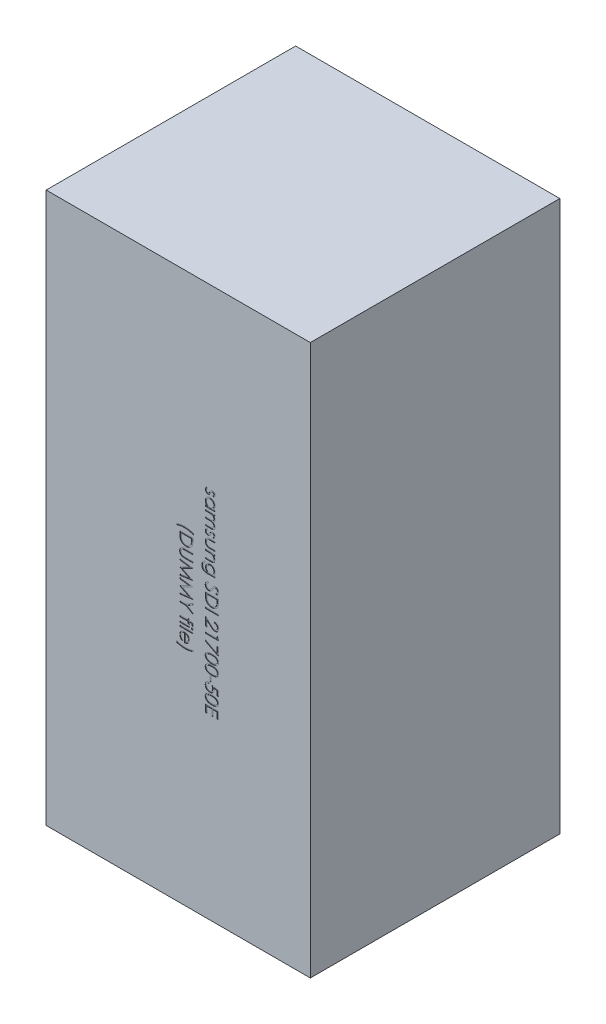
from build123d import *

# Parameters (mm, degrees)
SKETCH_1_W          = 72
SKETCH_1_H          = 150
EXTRUDE_1_DEPTH     = 68
SKETCH_2_W          = 3.5
SKETCH_2_H          = 0.314102564
SKETCH_2_W_2        = 0.358974359
SKETCH_2_H_2        = 1.346153846
SKETCH_2_W_3        = 2.557692308
SKETCH_2_W_4        = 3.58974359
CUT_EXTRUDE_1_DEPTH = 0.1


with BuildPart() as part:
    # 스케치1 → 보스-돌출1 (new body)
    with BuildSketch(Plane.XY):
        Rectangle(SKETCH_1_W, SKETCH_1_H)
    extrude(amount=EXTRUDE_1_DEPTH)

    # 스케치2 → 컷-돌출1 (cut)
    # profile 1 of 31: a face of its own
    with BuildSketch(Plane.XY.offset(68)):
        with BuildLine():
            Line((9.677728274, 25.330128205), (9.458277152, 25.543269231))
            add(Edge.make_bspline(
                [(9.458277152, 25.543269231), (9.479594906, 25.561656717), (9.520693027, 25.597105626), (9.575568614, 25.653377363), (9.622036646, 25.709413124), (9.660271885, 25.764917359), (9.690363371, 25.81999365), (9.711616671, 25.875112242), (9.724959416, 25.930121882), (9.726668622, 25.96691087), (9.727507921, 25.984975962)],
                knots=[0, 0, 0, 0, 1.265880991, 2.440469525, 3.530740057, 4.536711111, 5.468008477, 6.34654737, 7.188078389, 8, 8, 8, 8], degree=3))
            add(Edge.make_bspline(
                [(9.727507921, 25.984975962), (9.726422564, 26.007109166), (9.724286734, 26.050664181), (9.703390429, 26.112985036), (9.670544944, 26.170434889), (9.62488785, 26.220590746), (9.571853361, 26.262848778), (9.513276112, 26.294877994), (9.449591693, 26.313633658), (9.405579596, 26.31607133), (9.38325712, 26.317307692)],
                knots=[0, 0, 0, 0, 1.000196853, 1.968245854, 2.94569445, 3.981000421, 5.021494845, 6.007172807, 6.989258906, 8, 8, 8, 8], degree=3))
            add(Edge.make_bspline(
                [(9.38325712, 26.317307692), (9.363045076, 26.31619688), (9.322677965, 26.313978387), (9.263129931, 26.296731708), (9.205072893, 26.269265635), (9.169509987, 26.243595441), (9.151185806, 26.23036859)],
                knots=[0, 0, 0, 0, 0.960159726, 1.917612774, 2.927026955, 4, 4, 4, 4], degree=3))
            add(Edge.make_bspline(
                [(9.151185806, 26.23036859), (9.141401222, 26.222405096), (9.120575967, 26.205455803), (9.091672114, 26.173647288), (9.059729863, 26.137624785), (9.027793026, 26.094304848), (8.994161301, 26.04555382), (8.960159168, 25.990314535), (8.923194743, 25.930340031), (8.899750307, 25.887402724), (8.887564011, 25.865084135)],
                knots=[0, 0, 0, 0, 0.66740084, 1.420478572, 2.27185888, 3.217733974, 4.268547843, 5.408967954, 6.65319498, 8, 8, 8, 8], degree=3))
            add(Edge.make_bspline(
                [(8.887564011, 25.865084135), (8.872319108, 25.837870558), (8.842870976, 25.785302887), (8.797161272, 25.71061012), (8.751729848, 25.642823079), (8.707062574, 25.581367412), (8.661909707, 25.527425603), (8.61800195, 25.47936105), (8.574012641, 25.438372606), (8.543279528, 25.415418679), (8.528589652, 25.404447115)],
                knots=[0, 0, 0, 0, 1.27191281, 2.456916733, 3.569705269, 4.599008579, 5.553216877, 6.436649441, 7.252746552, 8, 8, 8, 8], degree=3))
            add(Edge.make_bspline(
                [(8.528589652, 25.404447115), (8.498955849, 25.38614531), (8.440051563, 25.349766087), (8.34239835, 25.31305356), (8.239676097, 25.289588218), (8.169045938, 25.286715905), (8.13315696, 25.28525641)],
                knots=[0, 0, 0, 0, 0.995606783, 1.979007074, 2.973082153, 4, 4, 4, 4], degree=3))
            add(Edge.make_bspline(
                [(8.13315696, 25.28525641), (8.107886996, 25.285974293), (8.058089772, 25.287388959), (7.984766675, 25.297270722), (7.914588987, 25.314138588), (7.847146064, 25.337518341), (7.782569362, 25.367499309), (7.721345334, 25.405180523), (7.662953989, 25.448870119), (7.607723552, 25.498311977), (7.557614494, 25.553224855), (7.514020248, 25.612272993), (7.477202208, 25.674567137), (7.446976544, 25.740122482), (7.422897476, 25.80907836), (7.406237916, 25.881491787), (7.396264346, 25.95711996), (7.394879982, 26.008549848), (7.394174588, 26.034755609)],
                knots=[0, 0, 0, 0, 1.032633728, 2.034917567, 3.017159222, 3.977707287, 4.947659047, 5.920662675, 6.910168127, 7.92466491, 8.94557085, 9.942744688, 10.919024275, 11.897637117, 12.88838639, 13.898512555, 14.929200919, 16, 16, 16, 16], degree=3))
            add(Edge.make_bspline(
                [(7.394174588, 26.034755609), (7.395167288, 26.070122784), (7.397138896, 26.140365711), (7.415644957, 26.24425543), (7.444440351, 26.345776189), (7.484156285, 26.444159729), (7.534306998, 26.537205843), (7.594369391, 26.622336768), (7.662359389, 26.69984823), (7.714472299, 26.743966504), (7.740528755, 26.766025641)],
                knots=[0, 0, 0, 0, 1.013940152, 2.01379169, 3.017749504, 4.037548394, 5.051665909, 6.043208538, 7.021604269, 8, 8, 8, 8], degree=3))
            Line((7.740528755, 26.766025641), (7.977507921, 26.557792468))
            add(Edge.make_bspline(
                [(7.977507921, 26.557792468), (7.956153157, 26.538020055), (7.914753717, 26.499688243), (7.859629376, 26.438387026), (7.813428105, 26.376007625), (7.77478469, 26.313172938), (7.745009287, 26.248952844), (7.724090693, 26.18370723), (7.710646501, 26.117568806), (7.709068219, 26.07314667), (7.708277152, 26.05088141)],
                knots=[0, 0, 0, 0, 1.179806542, 2.287233372, 3.337373186, 4.324005949, 5.273901747, 6.200048787, 7.097828587, 8, 8, 8, 8], degree=3))
            add(Edge.make_bspline(
                [(7.708277152, 26.05088141), (7.709647977, 26.020563484), (7.712326339, 25.961327343), (7.736643431, 25.876483584), (7.774773383, 25.798144958), (7.828858081, 25.730121612), (7.891813654, 25.672219451), (7.962727773, 25.630291277), (8.03951923, 25.604015101), (8.092751532, 25.600929103), (8.119835646, 25.599358974)],
                knots=[0, 0, 0, 0, 1.072336372, 2.095165389, 3.102688358, 4.141489647, 5.156069229, 6.117746104, 7.042326257, 8, 8, 8, 8], degree=3))
            add(Edge.make_bspline(
                [(8.119835646, 25.599358974), (8.142145264, 25.600445269), (8.18619262, 25.602590011), (8.249942961, 25.619433283), (8.310412242, 25.646046136), (8.345801889, 25.672250784), (8.36382603, 25.685596955)],
                knots=[0, 0, 0, 0, 1.013901739, 2.00181326, 2.98231254, 4, 4, 4, 4], degree=3))
            add(Edge.make_bspline(
                [(8.36382603, 25.685596955), (8.372861393, 25.69361935), (8.392543675, 25.711095022), (8.420968753, 25.743150263), (8.451606853, 25.781532125), (8.483938442, 25.826672288), (8.517537047, 25.87866175), (8.552226399, 25.937711226), (8.589654125, 26.003011778), (8.61447378, 26.04918241), (8.627447825, 26.073317308)],
                knots=[0, 0, 0, 0, 0.615000592, 1.339693406, 2.178160186, 3.116406724, 4.166410947, 5.330106347, 6.604359322, 8, 8, 8, 8], degree=3))
            add(Edge.make_bspline(
                [(8.627447825, 26.073317308), (8.641986957, 26.099363948), (8.670182973, 26.149876695), (8.714099053, 26.221423986), (8.758766328, 26.28597134), (8.801679167, 26.345071915), (8.845100111, 26.397232921), (8.889077363, 26.442248869), (8.931837349, 26.481892085), (8.962134646, 26.503839496), (8.976606479, 26.514322917)],
                knots=[0, 0, 0, 0, 1.262093308, 2.447601706, 3.550203992, 4.582594899, 5.537233252, 6.418365656, 7.244515135, 8, 8, 8, 8], degree=3))
            add(Edge.make_bspline(
                [(8.976606479, 26.514322917), (9.005752094, 26.532453516), (9.064053509, 26.568721052), (9.161363986, 26.603936243), (9.263809044, 26.628142272), (9.334495898, 26.630304662), (9.370636928, 26.631410256)],
                knots=[0, 0, 0, 0, 0.985009483, 1.970363186, 2.962279964, 4, 4, 4, 4], degree=3))
            add(Edge.make_bspline(
                [(9.370636928, 26.631410256), (9.394262272, 26.630875984), (9.440500418, 26.629830336), (9.508439996, 26.621487374), (9.572985383, 26.606291689), (9.635122269, 26.587251161), (9.693587683, 26.560715478), (9.74950055, 26.529199558), (9.801815547, 26.491167971), (9.850794089, 26.448419955), (9.895745302, 26.401947999), (9.934289633, 26.351050218), (9.967435648, 26.29754817), (9.995190245, 26.241130106), (10.016194497, 26.181312253), (10.030651096, 26.118497149), (10.040306514, 26.05281619), (10.041169569, 26.007915037), (10.041610486, 25.984975962)],
                knots=[0, 0, 0, 0, 1.087761869, 2.12890409, 3.144425528, 4.138218063, 5.116152125, 6.094559764, 7.089109474, 8.088306095, 9.085414286, 10.060442677, 11.0220762, 11.979848209, 12.949875201, 13.933947973, 14.944496518, 16, 16, 16, 16], degree=3))
            add(Edge.make_bspline(
                [(10.041610486, 25.984975962), (10.04050873, 25.957782564), (10.038284551, 25.902885648), (10.020538535, 25.820551837), (9.991638738, 25.738432577), (9.950787097, 25.656443703), (9.899405256, 25.574235906), (9.836161213, 25.492177673), (9.762840178, 25.408935811), (9.706732812, 25.356984357), (9.677728274, 25.330128205)],
                knots=[0, 0, 0, 0, 0.845753203, 1.707371858, 2.609134499, 3.549244224, 4.552329203, 5.621587647, 6.770486714, 8, 8, 8, 8], degree=3))
        make_face()
    # profile 2 of 31: a face of its own
    with BuildSketch(Plane.XY.offset(68)):
        with BuildLine():
            Line((9.996738691, 22.054487179), (7.439046383, 22.054487179))
            Line((7.439046383, 22.054487179), (7.439046383, 22.368589744))
            Line((7.439046383, 22.368589744), (7.881454236, 22.368589744))
            add(Edge.make_bspline(
                [(7.881454236, 22.368589744), (7.841403835, 22.404001128), (7.763244973, 22.47310689), (7.66144121, 22.588506876), (7.576600056, 22.710321993), (7.508713236, 22.838964165), (7.457330857, 22.974048499), (7.421197279, 23.115189767), (7.397675306, 23.262199863), (7.395351963, 23.362455679), (7.394174588, 23.413261218)],
                knots=[0, 0, 0, 0, 1.074295371, 2.096500925, 3.086030275, 4.053105238, 5.014108356, 5.985331429, 6.979048527, 8, 8, 8, 8], degree=3))
            add(Edge.make_bspline(
                [(7.394174588, 23.413261218), (7.395400757, 23.458429295), (7.397818816, 23.547502741), (7.416584046, 23.678530054), (7.446703862, 23.80462882), (7.488644522, 23.925879406), (7.543990303, 24.04146024), (7.610966342, 24.152022588), (7.689942923, 24.257824484), (7.780581559, 24.356853797), (7.878923884, 24.448161278), (7.984120324, 24.528046101), (8.094726007, 24.59575109), (8.210709847, 24.651392465), (8.33198706, 24.694450678), (8.458474447, 24.724407544), (8.589961541, 24.743152552), (8.679501446, 24.745569386), (8.724903755, 24.746794872)],
                knots=[0, 0, 0, 0, 1.034036272, 2.039165313, 3.024406509, 3.999331371, 4.971254918, 5.953351348, 6.95522652, 7.989525907, 9.023492927, 10.024309745, 11.009187477, 11.988246066, 12.964946762, 13.950187958, 14.960617622, 16, 16, 16, 16], degree=3))
            add(Edge.make_bspline(
                [(8.724903755, 24.746794872), (8.769367648, 24.745542206), (8.857270366, 24.743065752), (8.986546325, 24.724608122), (9.111074697, 24.693593396), (9.230394182, 24.649985227), (9.34498532, 24.594314264), (9.453951547, 24.525444902), (9.55895974, 24.445588866), (9.656642473, 24.353305539), (9.746545746, 24.253387402), (9.825714256, 24.146993555), (9.892518575, 24.035450622), (9.946823992, 23.918534946), (9.989978381, 23.797074392), (10.020061146, 23.670146288), (10.037744996, 23.538327854), (10.040309609, 23.448838302), (10.041610486, 23.403445513)],
                knots=[0, 0, 0, 0, 1.02050356, 2.017480486, 2.990790918, 3.96161403, 4.928589988, 5.909588639, 6.91611943, 7.952353252, 8.989586576, 9.99823133, 10.991940466, 11.968822692, 12.952985106, 13.945868367, 14.958059758, 16, 16, 16, 16], degree=3))
            add(Edge.make_bspline(
                [(10.041610486, 23.403445513), (10.040179735, 23.351243622), (10.037374099, 23.248878177), (10.013777281, 23.098955791), (9.974402183, 22.956997631), (9.920286404, 22.822185432), (9.848907242, 22.695042163), (9.758052636, 22.577132619), (9.649798158, 22.46608309), (9.566405692, 22.401719376), (9.523481479, 22.368589744)],
                knots=[0, 0, 0, 0, 1.03879612, 2.037030165, 3.012306674, 3.966139504, 4.922386257, 5.905048148, 6.921675258, 8, 8, 8, 8], degree=3))
            Line((9.523481479, 22.368589744), (9.996738691, 22.368589744))
            Line((9.996738691, 22.368589744), (9.996738691, 22.054487179))
        make_face()
        with BuildLine():
            add(Edge.make_bspline(
                [(9.727507921, 23.399238782), (9.725874301, 23.445153148), (9.722649795, 23.535780802), (9.697476046, 23.668824404), (9.655592407, 23.79613932), (9.598306912, 23.917079746), (9.526291502, 24.02976891), (9.439120829, 24.130385106), (9.33956695, 24.220132103), (9.226792867, 24.294333373), (9.107272318, 24.356892425), (8.981384342, 24.399792402), (8.852621439, 24.42833944), (8.765253135, 24.431237574), (8.721398146, 24.432692308)],
                knots=[0, 0, 0, 0, 1.031093775, 2.03521511, 3.029845951, 4.035119871, 5.034286494, 6.024708811, 7.017619509, 8.03559408, 9.050082311, 10.039808432, 11.016071318, 12, 12, 12, 12], degree=3))
            add(Edge.make_bspline(
                [(8.721398146, 24.432692308), (8.677813875, 24.430810223), (8.590816169, 24.427053432), (8.461670694, 24.400544882), (8.336289509, 24.354614551), (8.215113338, 24.293483416), (8.102107773, 24.217617755), (8.000607129, 24.128615599), (7.913086864, 24.026716362), (7.839832376, 23.913782766), (7.780865996, 23.793347591), (7.739286244, 23.666635949), (7.713030869, 23.535874205), (7.709867055, 23.446803639), (7.708277152, 23.402043269)],
                knots=[0, 0, 0, 0, 0.979154363, 1.954470772, 2.947816011, 3.971783346, 4.997163654, 5.998045606, 6.995988793, 8.00538986, 9.015323546, 10.000094788, 10.994993517, 12, 12, 12, 12], degree=3))
            add(Edge.make_bspline(
                [(7.708277152, 23.402043269), (7.709912256, 23.356591366), (7.713156045, 23.266421952), (7.738750797, 23.133065211), (7.780113668, 23.003450278), (7.838219079, 22.879505215), (7.909901506, 22.764126764), (7.994190408, 22.660704656), (8.091396502, 22.572393854), (8.199085834, 22.498361601), (8.31659076, 22.439879832), (8.442230556, 22.398631883), (8.575017877, 22.373297936), (8.665895676, 22.370180841), (8.712283562, 22.368589744)],
                knots=[0, 0, 0, 0, 1.017484689, 2.018529338, 3.030031036, 4.058138743, 5.076350332, 6.065651025, 7.036469986, 8.00785331, 8.984076697, 9.96571663, 10.961615403, 12, 12, 12, 12], degree=3))
            add(Edge.make_bspline(
                [(8.712283562, 22.368589744), (8.747621379, 22.369549415), (8.817177386, 22.371438352), (8.919305098, 22.385868705), (9.017038111, 22.408824425), (9.110483396, 22.441167708), (9.199108759, 22.483669728), (9.283608898, 22.534877033), (9.363196707, 22.595839961), (9.437771395, 22.664703254), (9.505450739, 22.740930285), (9.565102745, 22.821987852), (9.615584756, 22.907672017), (9.65598357, 22.997922634), (9.68889547, 23.092044585), (9.710633211, 23.190940013), (9.72560716, 23.293612232), (9.726867663, 23.36365922), (9.727507921, 23.399238782)],
                knots=[0, 0, 0, 0, 1.050062701, 2.066855696, 3.059271411, 4.030305351, 4.999747758, 5.975466543, 6.961907836, 7.974539719, 8.98812422, 9.98710676, 10.961662635, 11.93785114, 12.922015094, 13.919620009, 14.94329489, 16, 16, 16, 16], degree=3))
        make_face(mode=Mode.SUBTRACT)
    # profile 3 of 31: a face of its own
    with BuildSketch(Plane.XY.offset(68)):
        with BuildLine():
            Line((9.996738691, 21.336538462), (9.996738691, 21.022435897))
            Line((9.996738691, 21.022435897), (9.552227473, 21.022435897))
            add(Edge.make_bspline(
                [(9.552227473, 21.022435897), (9.591057539, 20.994090597), (9.665333607, 20.939870308), (9.764301985, 20.851812318), (9.846910945, 20.762328758), (9.890844303, 20.698340074), (9.911902954, 20.667668269)],
                knots=[0, 0, 0, 0, 1.134266299, 2.169680534, 3.122669868, 4, 4, 4, 4], degree=3))
            add(Edge.make_bspline(
                [(9.911902954, 20.667668269), (9.931908319, 20.625803607), (9.971569532, 20.542805707), (10.011803091, 20.411386482), (10.036528192, 20.276911813), (10.039909566, 20.186103599), (10.041610486, 20.140424679)],
                knots=[0, 0, 0, 0, 1.014936303, 2.012140481, 3.000054389, 4, 4, 4, 4], degree=3))
            add(Edge.make_bspline(
                [(10.041610486, 20.140424679), (10.040562421, 20.109532808), (10.038488357, 20.048399456), (10.025068817, 19.95779894), (10.001593089, 19.86979089), (9.969723113, 19.784946176), (9.929893955, 19.705493909), (9.884095027, 19.632516053), (9.832362319, 19.566908751), (9.7726927, 19.50877828), (9.703353471, 19.456510503), (9.622490027, 19.408431274), (9.528282121, 19.364006178), (9.459915617, 19.339384852), (9.423922184, 19.326422276)],
                knots=[0, 0, 0, 0, 1.009798505, 1.998336943, 2.985959917, 3.981996858, 4.955664737, 5.886087062, 6.794002107, 7.679958053, 8.601272429, 9.625787331, 10.750030247, 12, 12, 12, 12], degree=3))
            add(Edge.make_bspline(
                [(9.423922184, 19.326422276), (9.448646603, 19.312711024), (9.497300788, 19.285729207), (9.566159054, 19.240423571), (9.630565829, 19.192955769), (9.690572315, 19.142921297), (9.745881825, 19.090496632), (9.796678524, 19.035435515), (9.843175809, 18.978049694), (9.897513192, 18.898262505), (9.955003748, 18.794604269), (10.005497103, 18.663875126), (10.036051764, 18.52761401), (10.039748394, 18.434982353), (10.041610486, 18.388321314)],
                knots=[0, 0, 0, 0, 0.861170869, 1.694663331, 2.509326413, 3.297991968, 4.073691563, 4.829592376, 5.579160782, 6.321830913, 7.768780219, 9.179854006, 10.579417172, 12, 12, 12, 12], degree=3))
            add(Edge.make_bspline(
                [(10.041610486, 18.388321314), (10.039993265, 18.345439851), (10.036828206, 18.261516665), (10.011974733, 18.139339399), (9.969297086, 18.025397594), (9.911063449, 17.919920518), (9.837884266, 17.824760704), (9.750815429, 17.742044395), (9.650472805, 17.672274032), (9.556080817, 17.626695392), (9.472745484, 17.595780128), (9.401739193, 17.576718894), (9.32358764, 17.559879199), (9.238197378, 17.545897953), (9.14526677, 17.535679401), (9.044947894, 17.528108686), (8.937162782, 17.522984612), (8.862797282, 17.52262254), (8.82446305, 17.522435897)],
                knots=[0, 0, 0, 0, 1.209669288, 2.367440248, 3.500751976, 4.631527125, 5.755587489, 6.87532382, 8.007944318, 9.190864318, 9.82315674, 10.514484317, 11.263564316, 12.079023757, 12.955305781, 13.901327259, 14.918167583, 16, 16, 16, 16], degree=3))
            Line((8.82446305, 17.522435897), (7.439046383, 17.522435897))
            Line((7.439046383, 17.522435897), (7.439046383, 17.836538462))
            Line((7.439046383, 17.836538462), (8.825865293, 17.836538462))
            add(Edge.make_bspline(
                [(8.825865293, 17.836538462), (8.858585867, 17.836616345), (8.921469834, 17.836766024), (9.011722285, 17.839459655), (9.093990642, 17.84453497), (9.168162733, 17.850469607), (9.234411512, 17.858713421), (9.29260396, 17.869359338), (9.34319768, 17.880637064), (9.399284088, 17.899372875), (9.461151875, 17.929321975), (9.527885318, 17.974934537), (9.585928972, 18.032423155), (9.636617615, 18.098875095), (9.676999282, 18.174718738), (9.706929134, 18.257957964), (9.72462223, 18.348312025), (9.726529834, 18.410911922), (9.727507921, 18.443008814)],
                knots=[0, 0, 0, 0, 1.253542879, 2.409118771, 3.458568974, 4.411070626, 5.259544058, 6.014735414, 6.677123945, 7.243402448, 8.276608576, 9.299873988, 10.325604302, 11.392892819, 12.490509435, 13.603538441, 14.771260462, 16, 16, 16, 16], degree=3))
            add(Edge.make_bspline(
                [(9.727507921, 18.443008814), (9.726060925, 18.482670503), (9.723192796, 18.561284951), (9.694997289, 18.675853024), (9.651431811, 18.785649415), (9.589231829, 18.887722772), (9.514391237, 18.981738616), (9.425450166, 19.062641354), (9.324817921, 19.12947268), (9.231671799, 19.174726871), (9.148002269, 19.203316141), (9.074904918, 19.222193064), (8.991823344, 19.236876453), (8.899315855, 19.250646983), (8.796745674, 19.259634711), (8.684587273, 19.267803083), (8.562503314, 19.271623946), (8.477876625, 19.272158405), (8.43393821, 19.272435897)],
                knots=[0, 0, 0, 0, 1.090512009, 2.161531735, 3.230072964, 4.332825141, 5.440581378, 6.529496625, 7.62916386, 8.757669174, 9.370357692, 10.061947597, 10.834545503, 11.692923569, 12.636967211, 13.669242667, 14.789864225, 16, 16, 16, 16], degree=3))
            Line((8.43393821, 19.272435897), (7.439046383, 19.272435897))
            Line((7.439046383, 19.272435897), (7.439046383, 19.586538462))
            Line((7.439046383, 19.586538462), (8.739627312, 19.586538462))
            add(Edge.make_bspline(
                [(8.739627312, 19.586538462), (8.776321047, 19.586614333), (8.846916103, 19.586760303), (8.948144309, 19.589483484), (9.040243356, 19.594416154), (9.122981993, 19.600787099), (9.196585061, 19.607701751), (9.260811116, 19.618644377), (9.315927414, 19.630050975), (9.376961622, 19.647458486), (9.443168971, 19.677609675), (9.514288632, 19.723472871), (9.576966381, 19.780447746), (9.630116791, 19.848140277), (9.673683291, 19.924578639), (9.705558356, 20.008676401), (9.723943269, 20.099902273), (9.726297296, 20.162777035), (9.727507921, 20.195112179)],
                knots=[0, 0, 0, 0, 1.320226356, 2.539982809, 3.643122147, 4.638255983, 5.52602392, 6.301561104, 6.98107216, 7.550523949, 8.58191082, 9.584830316, 10.584890324, 11.614493144, 12.668965657, 13.738783174, 14.837104585, 16, 16, 16, 16], degree=3))
            add(Edge.make_bspline(
                [(9.727507921, 20.195112179), (9.725977461, 20.233128391), (9.722927309, 20.30889335), (9.695473036, 20.420195323), (9.652468959, 20.527680991), (9.592809149, 20.62963575), (9.518910036, 20.723309673), (9.431995267, 20.805318774), (9.333145753, 20.874258152), (9.240982801, 20.920000205), (9.159406061, 20.949476009), (9.090067379, 20.969151594), (9.01297764, 20.985651505), (8.928305522, 20.999637143), (8.835875284, 21.010161136), (8.735948154, 21.016457581), (8.628208525, 21.021992246), (8.553838507, 21.022284386), (8.515268338, 21.022435897)],
                knots=[0, 0, 0, 0, 1.098813768, 2.189896819, 3.297771711, 4.440532809, 5.596253211, 6.739894833, 7.8864334, 9.072265856, 9.705655743, 10.395080422, 11.156654178, 11.986235968, 12.878145268, 13.847797945, 14.883813667, 16, 16, 16, 16], degree=3))
            Line((8.515268338, 21.022435897), (7.439046383, 21.022435897))
            Line((7.439046383, 21.022435897), (7.439046383, 21.336538462))
            Line((7.439046383, 21.336538462), (9.996738691, 21.336538462))
        make_face()
    # profile 4 of 31: a face of its own
    with BuildSketch(Plane.XY.offset(68)):
        with BuildLine():
            Line((9.677728274, 15.592948718), (9.458277152, 15.806089744))
            add(Edge.make_bspline(
                [(9.458277152, 15.806089744), (9.479594906, 15.82447723), (9.520693027, 15.859926139), (9.575568614, 15.916197876), (9.622036646, 15.972233636), (9.660271885, 16.027737872), (9.690363371, 16.082814163), (9.711616671, 16.137932755), (9.724959416, 16.192942395), (9.726668622, 16.229731382), (9.727507921, 16.247796474)],
                knots=[0, 0, 0, 0, 1.265880991, 2.440469525, 3.530740057, 4.536711111, 5.468008477, 6.34654737, 7.188078389, 8, 8, 8, 8], degree=3))
            add(Edge.make_bspline(
                [(9.727507921, 16.247796474), (9.726422564, 16.269929679), (9.724286734, 16.313484694), (9.703390429, 16.375805549), (9.670544944, 16.433255401), (9.62488785, 16.483411259), (9.571853361, 16.525669291), (9.513276112, 16.557698507), (9.449591693, 16.576454171), (9.405579596, 16.578891843), (9.38325712, 16.580128205)],
                knots=[0, 0, 0, 0, 1.000196853, 1.968245854, 2.94569445, 3.981000421, 5.021494845, 6.007172807, 6.989258906, 8, 8, 8, 8], degree=3))
            add(Edge.make_bspline(
                [(9.38325712, 16.580128205), (9.363045076, 16.579017393), (9.322677965, 16.5767989), (9.263129931, 16.55955222), (9.205072893, 16.532086148), (9.169509987, 16.506415954), (9.151185806, 16.493189103)],
                knots=[0, 0, 0, 0, 0.960159726, 1.917612774, 2.927026955, 4, 4, 4, 4], degree=3))
            add(Edge.make_bspline(
                [(9.151185806, 16.493189103), (9.141401222, 16.485225609), (9.120575967, 16.468276316), (9.091672114, 16.436467801), (9.059729863, 16.400445298), (9.027793026, 16.35712536), (8.994161301, 16.308374333), (8.960159168, 16.253135048), (8.923194743, 16.193160543), (8.899750307, 16.150223237), (8.887564011, 16.127904647)],
                knots=[0, 0, 0, 0, 0.66740084, 1.420478572, 2.27185888, 3.217733974, 4.268547843, 5.408967954, 6.65319498, 8, 8, 8, 8], degree=3))
            add(Edge.make_bspline(
                [(8.887564011, 16.127904647), (8.872319108, 16.10069107), (8.842870976, 16.0481234), (8.797161272, 15.973430633), (8.751729848, 15.905643592), (8.707062574, 15.844187924), (8.661909707, 15.790246116), (8.61800195, 15.742181563), (8.574012641, 15.701193119), (8.543279528, 15.678239192), (8.528589652, 15.667267628)],
                knots=[0, 0, 0, 0, 1.27191281, 2.456916733, 3.569705269, 4.599008579, 5.553216877, 6.436649441, 7.252746552, 8, 8, 8, 8], degree=3))
            add(Edge.make_bspline(
                [(8.528589652, 15.667267628), (8.498955849, 15.648965823), (8.440051563, 15.6125866), (8.34239835, 15.575874073), (8.239676097, 15.552408731), (8.169045938, 15.549536418), (8.13315696, 15.548076923)],
                knots=[0, 0, 0, 0, 0.995606783, 1.979007074, 2.973082153, 4, 4, 4, 4], degree=3))
            add(Edge.make_bspline(
                [(8.13315696, 15.548076923), (8.107886996, 15.548794806), (8.058089772, 15.550209472), (7.984766675, 15.560091234), (7.914588987, 15.576959101), (7.847146064, 15.600338854), (7.782569362, 15.630319821), (7.721345334, 15.668001036), (7.662953989, 15.711690631), (7.607723552, 15.76113249), (7.557614494, 15.816045367), (7.514020248, 15.875093506), (7.477202208, 15.93738765), (7.446976544, 16.002942995), (7.422897476, 16.071898873), (7.406237916, 16.1443123), (7.396264346, 16.219940472), (7.394879982, 16.271370361), (7.394174588, 16.297576122)],
                knots=[0, 0, 0, 0, 1.032633728, 2.034917567, 3.017159222, 3.977707287, 4.947659047, 5.920662675, 6.910168127, 7.92466491, 8.94557085, 9.942744688, 10.919024275, 11.897637117, 12.88838639, 13.898512555, 14.929200919, 16, 16, 16, 16], degree=3))
            add(Edge.make_bspline(
                [(7.394174588, 16.297576122), (7.395167288, 16.332943297), (7.397138896, 16.403186224), (7.415644957, 16.507075943), (7.444440351, 16.608596702), (7.484156285, 16.706980242), (7.534306998, 16.800026356), (7.594369391, 16.885157281), (7.662359389, 16.962668743), (7.714472299, 17.006787017), (7.740528755, 17.028846154)],
                knots=[0, 0, 0, 0, 1.013940152, 2.01379169, 3.017749504, 4.037548394, 5.051665909, 6.043208538, 7.021604269, 8, 8, 8, 8], degree=3))
            Line((7.740528755, 17.028846154), (7.977507921, 16.820612981))
            add(Edge.make_bspline(
                [(7.977507921, 16.820612981), (7.956153157, 16.800840568), (7.914753717, 16.762508756), (7.859629376, 16.701207539), (7.813428105, 16.638828138), (7.77478469, 16.575993451), (7.745009287, 16.511773357), (7.724090693, 16.446527743), (7.710646501, 16.380389318), (7.709068219, 16.335967183), (7.708277152, 16.313701923)],
                knots=[0, 0, 0, 0, 1.179806542, 2.287233372, 3.337373186, 4.324005949, 5.273901747, 6.200048787, 7.097828587, 8, 8, 8, 8], degree=3))
            add(Edge.make_bspline(
                [(7.708277152, 16.313701923), (7.709647977, 16.283383997), (7.712326339, 16.224147856), (7.736643431, 16.139304097), (7.774773383, 16.06096547), (7.828858081, 15.992942125), (7.891813654, 15.935039964), (7.962727773, 15.893111789), (8.03951923, 15.866835614), (8.092751532, 15.863749615), (8.119835646, 15.862179487)],
                knots=[0, 0, 0, 0, 1.072336372, 2.095165389, 3.102688358, 4.141489647, 5.156069229, 6.117746104, 7.042326257, 8, 8, 8, 8], degree=3))
            add(Edge.make_bspline(
                [(8.119835646, 15.862179487), (8.142145264, 15.863265782), (8.18619262, 15.865410524), (8.249942961, 15.882253796), (8.310412242, 15.908866649), (8.345801889, 15.935071297), (8.36382603, 15.948417468)],
                knots=[0, 0, 0, 0, 1.013901739, 2.00181326, 2.98231254, 4, 4, 4, 4], degree=3))
            add(Edge.make_bspline(
                [(8.36382603, 15.948417468), (8.372861393, 15.956439862), (8.392543675, 15.973915535), (8.420968753, 16.005970776), (8.451606853, 16.044352638), (8.483938442, 16.089492801), (8.517537047, 16.141482263), (8.552226399, 16.200531739), (8.589654125, 16.265832291), (8.61447378, 16.312002922), (8.627447825, 16.336137821)],
                knots=[0, 0, 0, 0, 0.615000592, 1.339693406, 2.178160186, 3.116406724, 4.166410947, 5.330106347, 6.604359322, 8, 8, 8, 8], degree=3))
            add(Edge.make_bspline(
                [(8.627447825, 16.336137821), (8.641986957, 16.362184461), (8.670182973, 16.412697208), (8.714099053, 16.484244499), (8.758766328, 16.548791853), (8.801679167, 16.607892428), (8.845100111, 16.660053433), (8.889077363, 16.705069382), (8.931837349, 16.744712598), (8.962134646, 16.766660009), (8.976606479, 16.777143429)],
                knots=[0, 0, 0, 0, 1.262093308, 2.447601706, 3.550203992, 4.582594899, 5.537233252, 6.418365656, 7.244515135, 8, 8, 8, 8], degree=3))
            add(Edge.make_bspline(
                [(8.976606479, 16.777143429), (9.005752094, 16.795274029), (9.064053509, 16.831541564), (9.161363986, 16.866756756), (9.263809044, 16.890962784), (9.334495898, 16.893125175), (9.370636928, 16.894230769)],
                knots=[0, 0, 0, 0, 0.985009483, 1.970363186, 2.962279964, 4, 4, 4, 4], degree=3))
            add(Edge.make_bspline(
                [(9.370636928, 16.894230769), (9.394262272, 16.893696497), (9.440500418, 16.892650849), (9.508439996, 16.884307887), (9.572985383, 16.869112202), (9.635122269, 16.850071674), (9.693587683, 16.823535991), (9.74950055, 16.79202007), (9.801815547, 16.753988484), (9.850794089, 16.711240468), (9.895745302, 16.664768512), (9.934289633, 16.613870731), (9.967435648, 16.560368682), (9.995190245, 16.503950619), (10.016194497, 16.444132766), (10.030651096, 16.381317662), (10.040306514, 16.315636703), (10.041169569, 16.27073555), (10.041610486, 16.247796474)],
                knots=[0, 0, 0, 0, 1.087761869, 2.12890409, 3.144425528, 4.138218063, 5.116152125, 6.094559764, 7.089109474, 8.088306095, 9.085414286, 10.060442677, 11.0220762, 11.979848209, 12.949875201, 13.933947973, 14.944496518, 16, 16, 16, 16], degree=3))
            add(Edge.make_bspline(
                [(10.041610486, 16.247796474), (10.04050873, 16.220603076), (10.038284551, 16.165706161), (10.020538535, 16.08337235), (9.991638738, 16.00125309), (9.950787097, 15.919264216), (9.899405256, 15.837056419), (9.836161213, 15.754998186), (9.762840178, 15.671756324), (9.706732812, 15.61980487), (9.677728274, 15.592948718)],
                knots=[0, 0, 0, 0, 0.845753203, 1.707371858, 2.609134499, 3.549244224, 4.552329203, 5.621587647, 6.770486714, 8, 8, 8, 8], degree=3))
        make_face()
    # profile 5 of 31: a face of its own
    with BuildSketch(Plane.XY.offset(68)):
        with BuildLine():
            Line((9.996738691, 14.96474359), (9.996738691, 14.650641026))
            Line((9.996738691, 14.650641026), (8.810440614, 14.650641026))
            add(Edge.make_bspline(
                [(8.810440614, 14.650641026), (8.775617865, 14.650499121), (8.709003577, 14.650227663), (8.61314839, 14.648386722), (8.525731677, 14.644056629), (8.44670294, 14.638642804), (8.376075549, 14.631680668), (8.314096192, 14.623397308), (8.260062008, 14.614138886), (8.227518652, 14.605076172), (8.212383723, 14.600861378)],
                knots=[0, 0, 0, 0, 1.388932606, 2.656963016, 3.823490214, 4.879454478, 5.816252168, 6.653371382, 7.373723809, 8, 8, 8, 8], degree=3))
            add(Edge.make_bspline(
                [(8.212383723, 14.600861378), (8.193360905, 14.594099879), (8.155710749, 14.58071745), (8.101320973, 14.556444611), (8.050948556, 14.526413876), (8.002633847, 14.493562952), (7.957872059, 14.455629891), (7.916370837, 14.413169342), (7.877646054, 14.366934971), (7.83094087, 14.299210771), (7.781513831, 14.20663095), (7.738271354, 14.085354293), (7.712807958, 13.953616775), (7.709815334, 13.862459171), (7.708277152, 13.815604968)],
                knots=[0, 0, 0, 0, 0.725930277, 1.436768641, 2.137297926, 2.832005607, 3.535753883, 4.242956221, 4.964984144, 5.701683124, 7.198126434, 8.723945959, 10.316137162, 12, 12, 12, 12], degree=3))
            add(Edge.make_bspline(
                [(7.708277152, 13.815604968), (7.709809589, 13.768744827), (7.712767058, 13.678308864), (7.737886905, 13.547947811), (7.778867866, 13.428562692), (7.836874884, 13.321547438), (7.907592972, 13.227573846), (7.990607889, 13.149271402), (8.083255711, 13.084663642), (8.152380199, 13.056454289), (8.187143338, 13.042267628)],
                knots=[0, 0, 0, 0, 1.157091467, 2.233085092, 3.266839029, 4.264239195, 5.228693433, 6.160074799, 7.074690074, 8, 8, 8, 8], degree=3))
            add(Edge.make_bspline(
                [(8.187143338, 13.042267628), (8.20110934, 13.038070296), (8.231984759, 13.028791018), (8.284370613, 13.018892501), (8.346781884, 13.009606689), (8.419874002, 13.003415931), (8.503002413, 12.996350373), (8.596597008, 12.993910617), (8.700106108, 12.99042652), (8.772575677, 12.990398996), (8.810440614, 12.990384615)],
                knots=[0, 0, 0, 0, 0.557560243, 1.232629526, 2.036798082, 2.970922211, 4.03790722, 5.227863888, 6.551574656, 8, 8, 8, 8], degree=3))
            Line((8.810440614, 12.990384615), (9.996738691, 12.990384615))
            Line((9.996738691, 12.990384615), (9.996738691, 12.676282051))
            Line((9.996738691, 12.676282051), (8.751546383, 12.676282051))
            add(Edge.make_bspline(
                [(8.751546383, 12.676282051), (8.709239211, 12.676723745), (8.627157509, 12.677580691), (8.507873409, 12.683088049), (8.396711126, 12.692537612), (8.293612032, 12.706880465), (8.198654129, 12.723745576), (8.111718079, 12.745503715), (8.03306387, 12.771475729), (7.961337742, 12.800802166), (7.896236538, 12.835351423), (7.834815178, 12.872370704), (7.777175914, 12.913917229), (7.723035434, 12.959623039), (7.672590114, 13.009282854), (7.626059869, 13.063228448), (7.582621256, 13.120377761), (7.543124184, 13.181727095), (7.507916409, 13.247339103), (7.477219797, 13.316883669), (7.451861142, 13.390868099), (7.431125808, 13.468463607), (7.41395607, 13.550319535), (7.402447039, 13.636082933), (7.395120861, 13.725966109), (7.394495309, 13.787077577), (7.394174588, 13.818409455)],
                knots=[0, 0, 0, 0, 1.492959813, 2.896546261, 4.212934643, 5.4282803, 6.568701279, 7.614836728, 8.587629399, 9.489753423, 10.345563548, 11.185732697, 12.018869657, 12.849922188, 13.68387515, 14.5140269, 15.361852057, 16.215154979, 17.085973896, 17.987004002, 18.894652782, 19.842944701, 20.819888734, 21.843945232, 22.894589698, 24, 24, 24, 24], degree=3))
            add(Edge.make_bspline(
                [(7.394174588, 13.818409455), (7.394514295, 13.849505969), (7.395181851, 13.910613514), (7.402323659, 14.000284759), (7.41413183, 14.086233365), (7.430987047, 14.168153763), (7.452026117, 14.246128161), (7.477029653, 14.320472401), (7.508110134, 14.390315964), (7.543087692, 14.456497968), (7.582652967, 14.518500356), (7.626021007, 14.576608934), (7.67312707, 14.630745786), (7.723774427, 14.680922854), (7.778591363, 14.726435831), (7.837136924, 14.767851873), (7.898831012, 14.805808578), (7.964894175, 14.840161368), (8.037466185, 14.869673124), (8.117763282, 14.89572837), (8.206665798, 14.917039008), (8.304097727, 14.934381476), (8.409592768, 14.948332917), (8.523761184, 14.958019059), (8.646324876, 14.96343489), (8.730974766, 14.964297951), (8.774683402, 14.96474359)],
                knots=[0, 0, 0, 0, 1.083640291, 2.129454052, 3.13281866, 4.105697902, 5.042300162, 5.946461698, 6.836384745, 7.703652036, 8.553297018, 9.397182691, 10.228592656, 11.052265423, 11.879314572, 12.708807002, 13.549817954, 14.402308542, 15.300838682, 16.27712199, 17.341985831, 18.484375296, 19.725102775, 21.0496083, 22.476576903, 24, 24, 24, 24], degree=3))
            Line((8.774683402, 14.96474359), (9.996738691, 14.96474359))
        make_face()
    # profile 6 of 31: a face of its own
    with BuildSketch(Plane.XY.offset(68)):
        with BuildLine():
            Line((9.996738691, 11.958333333), (9.996738691, 11.644230769))
            Line((9.996738691, 11.644230769), (9.53540055, 11.644230769))
            add(Edge.make_bspline(
                [(9.53540055, 11.644230769), (9.577243272, 11.610693134), (9.658440536, 11.545612183), (9.765161111, 11.43722785), (9.853106336, 11.322683949), (9.92321013, 11.202681946), (9.976056756, 11.077058936), (10.014222687, 10.946580666), (10.037107515, 10.81046596), (10.040097746, 10.717901523), (10.041610486, 10.671073718)],
                knots=[0, 0, 0, 0, 1.12780773, 2.188550248, 3.19190651, 4.159438251, 5.104880172, 6.052711206, 7.014878035, 8, 8, 8, 8], degree=3))
            add(Edge.make_bspline(
                [(10.041610486, 10.671073718), (10.039862694, 10.623744363), (10.036441843, 10.531109398), (10.009461751, 10.396213309), (9.963110626, 10.270112657), (9.90025955, 10.153083682), (9.821679324, 10.047815681), (9.729641669, 9.956203943), (9.624587541, 9.879786053), (9.526827687, 9.828626369), (9.440144162, 9.794895311), (9.365896177, 9.773664241), (9.283178404, 9.755632872), (9.192238699, 9.740001243), (9.092440544, 9.729424095), (8.984192841, 9.721081814), (8.867530714, 9.715103117), (8.786844086, 9.71486591), (8.745236287, 9.71474359)],
                knots=[0, 0, 0, 0, 1.235764744, 2.418689688, 3.575570385, 4.733739044, 5.876600945, 6.994686206, 8.113221397, 9.257403329, 9.866223892, 10.540462211, 11.272173464, 12.077110251, 12.949508505, 13.892531187, 14.913238277, 16, 16, 16, 16], degree=3))
            Line((8.745236287, 9.71474359), (7.439046383, 9.71474359))
            Line((7.439046383, 9.71474359), (7.439046383, 10.028846154))
            Line((7.439046383, 10.028846154), (8.642171383, 10.028846154))
            add(Edge.make_bspline(
                [(8.642171383, 10.028846154), (8.676993828, 10.029039362), (8.743603239, 10.029408936), (8.838972262, 10.030574583), (8.92545884, 10.033384389), (9.002856208, 10.037332702), (9.071090044, 10.043111733), (9.130299321, 10.049134364), (9.180408863, 10.056499341), (9.210573946, 10.063062254), (9.224102473, 10.066005609)],
                knots=[0, 0, 0, 0, 1.430800155, 2.736877192, 3.918605307, 4.986035426, 5.920637409, 6.731861385, 7.431261377, 8, 8, 8, 8], degree=3))
            add(Edge.make_bspline(
                [(9.224102473, 10.066005609), (9.263813658, 10.07663114), (9.340245402, 10.097082001), (9.443919755, 10.147615984), (9.532117943, 10.211430165), (9.604294664, 10.289328014), (9.660465501, 10.38055709), (9.699439456, 10.484864233), (9.723815725, 10.601242874), (9.726242857, 10.683097256), (9.727507921, 10.725761218)],
                knots=[0, 0, 0, 0, 1.084156227, 2.086665306, 3.027808233, 3.945421172, 4.874247719, 5.839848303, 6.874090471, 8, 8, 8, 8], degree=3))
            add(Edge.make_bspline(
                [(9.727507921, 10.725761218), (9.727032094, 10.75102899), (9.726090444, 10.801033258), (9.716636561, 10.87518194), (9.701187783, 10.947110944), (9.680283466, 11.017513342), (9.651837096, 11.084895712), (9.618910036, 11.151227145), (9.578589697, 11.214609355), (9.533410205, 11.27624112), (9.483058851, 11.333512445), (9.430706641, 11.387565402), (9.374149535, 11.43505676), (9.315390268, 11.47816587), (9.253247681, 11.515333449), (9.188386254, 11.547789399), (9.120703335, 11.575324328), (9.073728377, 11.589007124), (9.050224268, 11.595853365)],
                knots=[0, 0, 0, 0, 1.02388931, 2.02625049, 3.024079426, 4.004119353, 4.998163158, 5.985366248, 7.002659681, 8.039138713, 9.080111048, 10.09169763, 11.086418407, 12.069932368, 13.043171485, 14.017654831, 15.008125612, 16, 16, 16, 16], degree=3))
            add(Edge.make_bspline(
                [(9.050224268, 11.595853365), (9.032969065, 11.599793014), (8.99540539, 11.608369423), (8.933760971, 11.617632603), (8.862450996, 11.626040178), (8.781558679, 11.633077137), (8.690800804, 11.637382553), (8.590564966, 11.64207695), (8.480451477, 11.643786011), (8.403789785, 11.644078365), (8.36382603, 11.644230769)],
                knots=[0, 0, 0, 0, 0.615963638, 1.340920617, 2.168419149, 3.115676021, 4.16674242, 5.331190069, 6.6087489, 8, 8, 8, 8], degree=3))
            Line((8.36382603, 11.644230769), (7.439046383, 11.644230769))
            Line((7.439046383, 11.644230769), (7.439046383, 11.958333333))
            Line((7.439046383, 11.958333333), (9.996738691, 11.958333333))
        make_face()
    # profile 7 of 31: a face of its own
    with BuildSketch(Plane.XY.offset(68)):
        with BuildLine():
            Line((9.996738691, 6.753205128), (9.996738691, 6.439102564))
            Line((9.996738691, 6.439102564), (7.966991095, 6.439102564))
            add(Edge.make_bspline(
                [(7.966991095, 6.439102564), (7.9237535, 6.439379607), (7.840294527, 6.439914366), (7.719616248, 6.443765337), (7.608150162, 6.451886014), (7.505387903, 6.461094695), (7.411805793, 6.474341412), (7.327124589, 6.490517779), (7.251263026, 6.508753458), (7.204538185, 6.524773676), (7.182435806, 6.532351763)],
                knots=[0, 0, 0, 0, 1.307562039, 2.523909702, 3.650326591, 4.686913197, 5.643429486, 6.506965704, 7.293745905, 8, 8, 8, 8], degree=3))
            add(Edge.make_bspline(
                [(7.182435806, 6.532351763), (7.153704884, 6.543539918), (7.097102077, 6.56558171), (7.016882113, 6.606882898), (6.941282512, 6.653059151), (6.871167097, 6.705985404), (6.805432704, 6.764322696), (6.745227192, 6.829142264), (6.689616169, 6.899291561), (6.639699882, 6.975341455), (6.595960015, 7.056521515), (6.557245388, 7.141752054), (6.523808933, 7.230786681), (6.498712235, 7.324481795), (6.476981369, 7.421414186), (6.462835606, 7.522711014), (6.453208846, 7.627783978), (6.452318572, 7.699229335), (6.451866896, 7.735476763)],
                knots=[0, 0, 0, 0, 0.981884813, 1.934411902, 2.870642727, 3.801527012, 4.729816098, 5.667674509, 6.616731011, 7.579249157, 8.562291171, 9.552107921, 10.560574871, 11.588648803, 12.640348669, 13.724070705, 14.845319185, 16, 16, 16, 16], degree=3))
            add(Edge.make_bspline(
                [(6.451866896, 7.735476763), (6.452721483, 7.788362023), (6.454390722, 7.891661145), (6.473908107, 8.042258808), (6.501325653, 8.185100248), (6.543261096, 8.318377807), (6.594366409, 8.441576432), (6.65257437, 8.554143268), (6.719990674, 8.654226906), (6.796462788, 8.744365773), (6.887434408, 8.825703129), (6.994630855, 8.902231698), (7.119698477, 8.975892249), (7.211491082, 9.019060944), (7.259559204, 9.041666667)],
                knots=[0, 0, 0, 0, 1.157931887, 2.261752077, 3.322178827, 4.340878186, 5.316509817, 6.24181319, 7.112369066, 7.954886437, 8.824930176, 9.778504873, 10.836691706, 12, 12, 12, 12], degree=3))
            Line((7.259559204, 9.041666667), (7.259559204, 8.727564103))
            add(Edge.make_bspline(
                [(7.259559204, 8.727564103), (7.219453328, 8.702301893), (7.141051279, 8.652917385), (7.039538123, 8.560568904), (6.952784759, 8.459362578), (6.882873985, 8.345882894), (6.830164193, 8.219657679), (6.792588897, 8.080610993), (6.77009263, 7.927611371), (6.767381336, 7.821093157), (6.76596946, 7.765625)],
                knots=[0, 0, 0, 0, 0.997731894, 1.950442991, 2.880492273, 3.800895997, 4.748200782, 5.754801363, 6.83083817, 8, 8, 8, 8], degree=3))
            add(Edge.make_bspline(
                [(6.76596946, 7.765625), (6.767393107, 7.710856683), (6.770137756, 7.605268851), (6.792700023, 7.453233245), (6.830069836, 7.314362297), (6.882586139, 7.189699077), (6.947447437, 7.081126816), (7.019208682, 6.987205427), (7.100417987, 6.911077731), (7.175193314, 6.859860877), (7.241818333, 6.828026793), (7.299170724, 6.807754433), (7.364023665, 6.791280502), (7.436159382, 6.777500653), (7.515681045, 6.766129743), (7.602770446, 6.758926859), (7.697229669, 6.753721048), (7.762722807, 6.753381078), (7.796618498, 6.753205128)],
                knots=[0, 0, 0, 0, 1.570672572, 3.028099501, 4.397683431, 5.686589315, 6.895122698, 8.017723291, 9.066023084, 10.075791025, 10.603605416, 11.180458235, 11.81795017, 12.521450677, 13.286658401, 14.121327423, 15.027701111, 16, 16, 16, 16], degree=3))
            Line((7.796618498, 6.753205128), (7.929130518, 6.753205128))
            add(Edge.make_bspline(
                [(7.929130518, 6.753205128), (7.891188715, 6.785086246), (7.815972496, 6.848287701), (7.717410859, 6.957435028), (7.632524729, 7.076651944), (7.562906094, 7.205735486), (7.50722467, 7.341523729), (7.468281709, 7.482545959), (7.443121809, 7.627538014), (7.440414493, 7.725790164), (7.439046383, 7.775440705)],
                knots=[0, 0, 0, 0, 1.012485704, 2.007162095, 2.997754123, 3.998611389, 4.999708251, 5.992315798, 6.98544096, 8, 8, 8, 8], degree=3))
            add(Edge.make_bspline(
                [(7.439046383, 7.775440705), (7.439561409, 7.804676975), (7.440585368, 7.862803532), (7.449544145, 7.949158279), (7.462542887, 8.034238718), (7.481624326, 8.117846421), (7.506116053, 8.200102035), (7.536732793, 8.280869625), (7.571347906, 8.36080316), (7.612120728, 8.438449626), (7.657482964, 8.513035874), (7.706622114, 8.583998633), (7.759279454, 8.65096873), (7.815979889, 8.713299477), (7.876620559, 8.770943283), (7.940632032, 8.824548415), (8.008517851, 8.873630261), (8.080304438, 8.917552708), (8.154241554, 8.957680215), (8.230683354, 8.992036638), (8.309146236, 9.020556888), (8.388649296, 9.045691997), (8.470642303, 9.063490759), (8.554153468, 9.077100733), (8.639692279, 9.084736807), (8.697312488, 9.085935367), (8.726305998, 9.086538462)],
                knots=[0, 0, 0, 0, 1.028796061, 2.045417375, 3.052978994, 4.056772505, 5.061374657, 6.071351207, 7.095367434, 8.125609542, 9.155490328, 10.16637099, 11.162041966, 12.151987513, 13.129482149, 14.104793677, 15.088808581, 16.075021637, 17.065069715, 18.0481558, 19.021557435, 20.00254184, 20.980451754, 21.971763498, 22.979425854, 24, 24, 24, 24], degree=3))
            add(Edge.make_bspline(
                [(8.726305998, 9.086538462), (8.755309233, 9.086019659), (8.813203369, 9.084984062), (8.899080693, 9.07602769), (8.983817823, 9.06327963), (9.066495372, 9.042997061), (9.14830691, 9.018930402), (9.227920496, 8.987716937), (9.306389739, 8.951755044), (9.383026513, 8.910652315), (9.457125754, 8.86464221), (9.52716983, 8.813997485), (9.593741362, 8.759776867), (9.655986505, 8.700889186), (9.71437181, 8.637682535), (9.768384941, 8.569973181), (9.819002197, 8.498514221), (9.865112653, 8.423060901), (9.905895136, 8.3447838), (9.943107671, 8.265669907), (9.972641807, 8.184671691), (9.998664901, 8.103299147), (10.017100098, 8.020119233), (10.031322339, 7.936151839), (10.039987061, 7.851109502), (10.041068646, 7.794156607), (10.041610486, 7.765625)],
                knots=[0, 0, 0, 0, 1.008914434, 2.013921196, 3.001938835, 3.98818112, 4.973517748, 5.967241793, 6.960633033, 7.975722852, 8.991170928, 9.993245185, 10.981396684, 11.976616977, 12.972235889, 13.973022409, 14.988340224, 16.01763096, 17.047082309, 18.058647952, 19.057085865, 20.044802253, 21.029198803, 22.0185208, 23.007341325, 24, 24, 24, 24], degree=3))
            add(Edge.make_bspline(
                [(10.041610486, 7.765625), (10.040274952, 7.718570263), (10.037644246, 7.625882847), (10.016361738, 7.489207951), (9.983190604, 7.357180179), (9.934970109, 7.229123195), (9.869714453, 7.10425535), (9.78265555, 6.983328151), (9.675513041, 6.864271409), (9.592523269, 6.791169963), (9.549422986, 6.753205128)],
                knots=[0, 0, 0, 0, 0.967343326, 1.905452219, 2.838102277, 3.762990896, 4.713322225, 5.726933809, 6.819495538, 8, 8, 8, 8], degree=3))
            Line((9.549422986, 6.753205128), (9.996738691, 6.753205128))
        make_face()
        with BuildLine():
            add(Edge.make_bspline(
                [(9.727507921, 7.740384615), (9.72594687, 7.786315339), (9.722856318, 7.877248432), (9.696471404, 8.010536489), (9.655126262, 8.139214497), (9.595980773, 8.260815854), (9.523897148, 8.374738001), (9.436518111, 8.475757919), (9.337014061, 8.564281116), (9.225340528, 8.638236183), (9.105411876, 8.697660571), (8.979162277, 8.740863662), (8.848046415, 8.767858737), (8.758685558, 8.770902925), (8.713685806, 8.772435897)],
                knots=[0, 0, 0, 0, 1.026331696, 2.03191913, 3.02692423, 4.041490544, 5.047661868, 6.033509946, 7.018359977, 8.017132933, 9.01989117, 10.003339456, 10.994534818, 12, 12, 12, 12], degree=3))
            add(Edge.make_bspline(
                [(8.713685806, 8.772435897), (8.679752329, 8.771710472), (8.613015104, 8.770283772), (8.51508012, 8.756555473), (8.421789197, 8.734391712), (8.33319907, 8.702892486), (8.248460972, 8.664118547), (8.169141665, 8.614176356), (8.093785791, 8.556697979), (8.023942026, 8.490767027), (7.960234541, 8.418228305), (7.904548706, 8.339599718), (7.858378192, 8.255311887), (7.819066612, 8.166711624), (7.790147247, 8.071923148), (7.768119766, 7.972367815), (7.755507882, 7.867377847), (7.753945518, 7.795805868), (7.753148947, 7.759314904)],
                knots=[0, 0, 0, 0, 1.039892369, 2.045164194, 3.025377528, 3.974939947, 4.923826224, 5.876304068, 6.842270891, 7.825700405, 8.815919897, 9.798017152, 10.773083594, 11.758208475, 12.764450271, 13.80592145, 14.881349344, 16, 16, 16, 16], degree=3))
            add(Edge.make_bspline(
                [(7.753148947, 7.759314904), (7.753916556, 7.722351145), (7.755417607, 7.650068908), (7.768321107, 7.544497974), (7.789143079, 7.444465223), (7.81870612, 7.350062438), (7.856427813, 7.260932963), (7.904164642, 7.17807884), (7.958528288, 7.09972056), (8.021943242, 7.028371003), (8.091817308, 6.963821368), (8.167902473, 6.907684444), (8.248730383, 6.85947172), (8.335331552, 6.821099268), (8.426561605, 6.789446514), (8.52395886, 6.769491371), (8.626089807, 6.755179499), (8.696103701, 6.753873256), (8.731914973, 6.753205128)],
                knots=[0, 0, 0, 0, 1.121992135, 2.194043731, 3.223932285, 4.220423016, 5.193184374, 6.156086365, 7.118779155, 8.084057622, 9.048292205, 10.002025119, 10.950065319, 11.899697616, 12.87359713, 13.875731462, 14.913461982, 16, 16, 16, 16], degree=3))
            add(Edge.make_bspline(
                [(8.731914973, 6.753205128), (8.778532827, 6.754544696), (8.869607734, 6.757161741), (9.002314492, 6.781858902), (9.127083203, 6.821679101), (9.243519043, 6.877525895), (9.350389093, 6.947507748), (9.445711089, 7.031799174), (9.529618933, 7.128943021), (9.599490166, 7.238673546), (9.656152722, 7.356889577), (9.698102367, 7.480534618), (9.722418051, 7.609259989), (9.725798543, 7.696347822), (9.727507921, 7.740384615)],
                knots=[0, 0, 0, 0, 1.070930318, 2.092221514, 3.091405799, 4.074392322, 5.052047932, 6.019043127, 6.99061078, 7.993717296, 9.000730765, 9.998165278, 10.987753177, 12, 12, 12, 12], degree=3))
        make_face(mode=Mode.SUBTRACT)
    # profile 8 of 31: a face of its own
    with BuildSketch(Plane.XY.offset(68)):
        with BuildLine():
            Line((8.114226671, 4.644230769), (8.291610486, 4.348357372))
            add(Edge.make_bspline(
                [(8.291610486, 4.348357372), (8.245546101, 4.320839135), (8.157288517, 4.268115254), (8.038030476, 4.180163895), (7.93666832, 4.089030984), (7.853791712, 3.99404165), (7.788542825, 3.895775702), (7.742340594, 3.793591648), (7.713524618, 3.687833837), (7.710024532, 3.615860016), (7.708277152, 3.579927885)],
                knots=[0, 0, 0, 0, 1.272034388, 2.437168799, 3.508375237, 4.49857839, 5.41946034, 6.295179144, 7.148887113, 8, 8, 8, 8], degree=3))
            add(Edge.make_bspline(
                [(7.708277152, 3.579927885), (7.709131824, 3.549241021), (7.710826212, 3.488404242), (7.72710703, 3.398842045), (7.752119099, 3.311860068), (7.787940252, 3.229252085), (7.831277938, 3.152154104), (7.883626927, 3.084555728), (7.942223154, 3.026080092), (8.0076421, 2.978378347), (8.077755013, 2.941347173), (8.150366374, 2.914550391), (8.225156788, 2.897495851), (8.275862432, 2.89532515), (8.301426191, 2.894230769)],
                knots=[0, 0, 0, 0, 1.095270387, 2.171376115, 3.241375676, 4.322296363, 5.380636668, 6.392615365, 7.366724986, 8.328592944, 9.273498763, 10.190095884, 11.087518669, 12, 12, 12, 12], degree=3))
            add(Edge.make_bspline(
                [(8.301426191, 2.894230769), (8.33056704, 2.89570508), (8.38980613, 2.898702138), (8.477205782, 2.924033618), (8.563698353, 2.963882865), (8.617199618, 3.000645509), (8.64497587, 3.019731571)],
                knots=[0, 0, 0, 0, 0.938893495, 1.908633276, 2.914225137, 4, 4, 4, 4], degree=3))
            add(Edge.make_bspline(
                [(8.64497587, 3.019731571), (8.665063674, 3.035357822), (8.707359296, 3.068259477), (8.769264767, 3.125606165), (8.834680609, 3.191147886), (8.903341185, 3.265212302), (8.973992581, 3.34927166), (9.048107534, 3.441599902), (9.125463298, 3.542674974), (9.17661791, 3.613908117), (9.203068819, 3.650741186)],
                knots=[0, 0, 0, 0, 0.72226686, 1.520759855, 2.393439377, 3.351307446, 4.386958158, 5.510256019, 6.712608938, 8, 8, 8, 8], degree=3))
            add(Edge.make_bspline(
                [(9.203068819, 3.650741186), (9.22930341, 3.68756027), (9.27946195, 3.757955555), (9.353808622, 3.856477639), (9.422215775, 3.944459949), (9.483730522, 4.022350799), (9.541035825, 4.088135053), (9.59106044, 4.1442176), (9.636475625, 4.188529343), (9.665913595, 4.213187783), (9.679130518, 4.224258814)],
                knots=[0, 0, 0, 0, 1.452255772, 2.776602448, 3.96446981, 5.032613149, 5.964194703, 6.766668629, 7.446264616, 8, 8, 8, 8], degree=3))
            add(Edge.make_bspline(
                [(9.679130518, 4.224258814), (9.699731554, 4.239731359), (9.740246258, 4.270160196), (9.803571116, 4.310326202), (9.868394381, 4.344465364), (9.934890246, 4.371227696), (10.002125175, 4.393763915), (10.070976421, 4.408921846), (10.141135039, 4.418413243), (10.18834854, 4.419385229), (10.211983082, 4.419871795)],
                knots=[0, 0, 0, 0, 1.068054152, 2.10047183, 3.106115577, 4.101338837, 5.06977816, 6.043150881, 7.020423561, 8, 8, 8, 8], degree=3))
            add(Edge.make_bspline(
                [(10.211983082, 4.419871795), (10.249015957, 4.418572279), (10.322290155, 4.416001025), (10.429276002, 4.394077903), (10.53173063, 4.359879283), (10.627397274, 4.310418064), (10.716052217, 4.249265685), (10.796340957, 4.176993178), (10.864411886, 4.091185484), (10.923197052, 3.996512901), (10.969610398, 3.893555204), (11.004807994, 3.785861221), (11.024485605, 3.67295871), (11.027341086, 3.596359073), (11.028789973, 3.557491987)],
                knots=[0, 0, 0, 0, 1.005541892, 1.989591032, 2.955705311, 3.932863626, 4.905387107, 5.876519979, 6.856563935, 7.871847665, 8.897921447, 9.918317993, 10.943742853, 12, 12, 12, 12], degree=3))
            add(Edge.make_bspline(
                [(11.028789973, 3.557491987), (11.027394069, 3.516241739), (11.024625826, 3.434437564), (10.99969481, 3.313881517), (10.959423325, 3.197587746), (10.913040343, 3.103976958), (10.866922451, 3.030839832), (10.824899632, 2.975068066), (10.776525413, 2.918550328), (10.721665904, 2.860832358), (10.659819231, 2.802891673), (10.591408519, 2.743868229), (10.51685197, 2.683623958), (10.463627468, 2.644868098), (10.436342056, 2.625)],
                knots=[0, 0, 0, 0, 1.286821612, 2.551921131, 3.825787379, 5.12137259, 5.803616487, 6.523126609, 7.299589446, 8.125436757, 9.008162487, 9.944516264, 10.946261234, 12, 12, 12, 12], degree=3))
            Line((10.436342056, 2.625), (10.221097665, 2.908954327))
            add(Edge.make_bspline(
                [(10.221097665, 2.908954327), (10.243186356, 2.926100259), (10.28572401, 2.959119316), (10.345295318, 3.009248805), (10.399711825, 3.056497444), (10.446976862, 3.103047873), (10.489679294, 3.14644141), (10.526238069, 3.188558765), (10.557016853, 3.228792101), (10.589847104, 3.279513249), (10.622597709, 3.343398811), (10.649720801, 3.423514564), (10.666606816, 3.507009649), (10.668734257, 3.563721838), (10.669815614, 3.592548077)],
                knots=[0, 0, 0, 0, 1.181667846, 2.275615987, 3.290305621, 4.226321945, 5.078535498, 5.862783384, 6.581873284, 7.217493746, 8.414623899, 9.604724551, 10.782505457, 12, 12, 12, 12], degree=3))
            add(Edge.make_bspline(
                [(10.669815614, 3.592548077), (10.668603914, 3.628704599), (10.666267265, 3.698429047), (10.640747279, 3.797419283), (10.600565419, 3.886513208), (10.544250441, 3.963065773), (10.477529448, 4.02680275), (10.400750593, 4.072908209), (10.315968191, 4.100658373), (10.256826534, 4.104044653), (10.226706639, 4.105769231)],
                knots=[0, 0, 0, 0, 1.14458467, 2.207223713, 3.21896685, 4.227309161, 5.202851033, 6.127160689, 7.046193047, 8, 8, 8, 8], degree=3))
            add(Edge.make_bspline(
                [(10.226706639, 4.105769231), (10.207959942, 4.105357803), (10.170435892, 4.104534274), (10.114851254, 4.0938234), (10.059760022, 4.078635704), (10.004917227, 4.056407574), (9.949032651, 4.026467282), (9.892257175, 3.985757486), (9.833157355, 3.934827854), (9.794757205, 3.895738279), (9.774483082, 3.87510016)],
                knots=[0, 0, 0, 0, 0.858526328, 1.718456515, 2.587092892, 3.476767204, 4.426280253, 5.487868114, 6.673670035, 8, 8, 8, 8], degree=3))
            add(Edge.make_bspline(
                [(9.774483082, 3.87510016), (9.767646056, 3.867438788), (9.751402848, 3.849237121), (9.724810567, 3.815961195), (9.692007795, 3.772018397), (9.651420478, 3.718556196), (9.604339016, 3.654588834), (9.551365404, 3.580109278), (9.490779945, 3.495947745), (9.448422404, 3.436225829), (9.42602555, 3.404647436)],
                knots=[0, 0, 0, 0, 0.420754252, 0.999615792, 1.744751191, 2.668019286, 3.750313428, 4.999500688, 6.413464383, 8, 8, 8, 8], degree=3))
            add(Edge.make_bspline(
                [(9.42602555, 3.404647436), (9.39838419, 3.366661523), (9.344860528, 3.293107066), (9.264444848, 3.188449486), (9.18579708, 3.093555678), (9.109419473, 3.008092475), (9.03589138, 2.931215566), (8.964328199, 2.863777846), (8.895242627, 2.805092165), (8.806670051, 2.741912947), (8.697888967, 2.677355127), (8.564610728, 2.62191362), (8.430814408, 2.586955272), (8.340887571, 2.582383757), (8.296518338, 2.580128205)],
                knots=[0, 0, 0, 0, 1.163667725, 2.253281268, 3.268753668, 4.215851969, 5.092017293, 5.902905408, 6.650798638, 7.335211899, 8.59617414, 9.77448103, 10.901945474, 12, 12, 12, 12], degree=3))
            add(Edge.make_bspline(
                [(8.296518338, 2.580128205), (8.26514022, 2.580785708), (8.202993327, 2.582087946), (8.111734653, 2.597043552), (8.023117161, 2.61898296), (7.938155946, 2.651946256), (7.855714157, 2.692494224), (7.776551197, 2.742576785), (7.701755312, 2.802951279), (7.629770005, 2.870055085), (7.564746578, 2.944629716), (7.506590404, 3.023261527), (7.457914053, 3.106461006), (7.418729464, 3.193825457), (7.387597106, 3.284871598), (7.365219817, 3.379695244), (7.351454453, 3.478560452), (7.35002802, 3.545761526), (7.349302793, 3.579927885)],
                knots=[0, 0, 0, 0, 0.983610584, 1.948120116, 2.894308362, 3.843560551, 4.801159957, 5.773581695, 6.77566113, 7.813174769, 8.857584665, 9.875476876, 10.877851407, 11.875574773, 12.875048225, 13.892438445, 14.928473903, 16, 16, 16, 16], degree=3))
            add(Edge.make_bspline(
                [(7.349302793, 3.579927885), (7.349819832, 3.606362061), (7.350847398, 3.658897502), (7.35971653, 3.7363952), (7.372723219, 3.812469804), (7.392553709, 3.886166108), (7.417180028, 3.958401763), (7.447331393, 4.028532883), (7.48322506, 4.096729855), (7.524920481, 4.163072315), (7.572972984, 4.228185399), (7.628504652, 4.29173529), (7.691131917, 4.354449006), (7.761497034, 4.415176908), (7.838848226, 4.475038368), (7.92383362, 4.532920156), (8.01601205, 4.590000914), (8.080876983, 4.625816518), (8.114226671, 4.644230769)],
                knots=[0, 0, 0, 0, 0.915384692, 1.819241058, 2.699029451, 3.586605375, 4.459625921, 5.340865773, 6.228072412, 7.126546901, 8.052715223, 9.028303326, 10.047266019, 11.120332924, 12.245748783, 13.433636234, 14.680528497, 16, 16, 16, 16], degree=3))
        make_face()
    # profile 9 of 31: a face of its own
    with BuildSketch(Plane.XY.offset(68)):
        with BuildLine():
            Line((7.439046383, 1.862179487), (10.939046383, 1.862179487))
            Line((10.939046383, 1.862179487), (10.939046383, 1.155448718))
            add(Edge.make_bspline(
                [(10.939046383, 1.155448718), (10.938605019, 1.093979602), (10.937752306, 0.97522159), (10.932314761, 0.803610854), (10.92279286, 0.645053562), (10.908655548, 0.499639758), (10.891686812, 0.367135821), (10.870106816, 0.247753972), (10.844727279, 0.141300744), (10.82308081, 0.075831431), (10.81284446, 0.044871795)],
                knots=[0, 0, 0, 0, 1.314317071, 2.539253741, 3.67075822, 4.709970291, 5.662644612, 6.526156501, 7.303037452, 8, 8, 8, 8], degree=3))
            add(Edge.make_bspline(
                [(10.81284446, 0.044871795), (10.797413737, 0.004377081), (10.766902209, -0.07569406), (10.709346159, -0.189701556), (10.64413212, -0.29702553), (10.57117971, -0.398249794), (10.488402478, -0.491031516), (10.399393869, -0.579111294), (10.300516744, -0.658535156), (10.195128278, -0.732490427), (10.082159352, -0.797202498), (9.963902721, -0.854271028), (9.840579657, -0.902997589), (9.711292549, -0.941017725), (9.577282546, -0.972428834), (9.437535195, -0.99350494), (9.292865186, -1.007504944), (9.194689459, -1.008905003), (9.14487571, -1.009615385)],
                knots=[0, 0, 0, 0, 0.98467389, 1.947018643, 2.898343565, 3.837828625, 4.779009928, 5.722093987, 6.681368302, 7.658573986, 8.646467994, 9.637429229, 10.641859304, 11.657149908, 12.698561448, 13.768651538, 14.867827761, 16, 16, 16, 16], degree=3))
            add(Edge.make_bspline(
                [(9.14487571, -1.009615385), (9.101614618, -1.008985993), (9.016364117, -1.007745712), (8.890721127, -0.996622463), (8.768815208, -0.980423973), (8.651181757, -0.955460174), (8.537028342, -0.924785684), (8.426897062, -0.886923904), (8.320707194, -0.84205403), (8.219323729, -0.789995964), (8.122914386, -0.73307278), (8.033138201, -0.670659839), (7.948287749, -0.606338607), (7.872190228, -0.535149504), (7.800493369, -0.461998251), (7.737071084, -0.383005778), (7.679160749, -0.300745612), (7.627185066, -0.213633295), (7.582090404, -0.119580876), (7.543458609, -0.017304664), (7.511649204, 0.093743101), (7.485067433, 0.21339221), (7.463993322, 0.34187711), (7.449865995, 0.479315659), (7.44031333, 0.625499068), (7.439476899, 0.725878317), (7.439046383, 0.777544071)],
                knots=[0, 0, 0, 0, 1.105818345, 2.179130549, 3.222742436, 4.24813173, 5.251184997, 6.243232575, 7.223185975, 8.195898781, 9.155064964, 10.083206407, 10.990357329, 11.874224667, 12.744762365, 13.607037788, 14.46074101, 15.315384698, 16.197310979, 17.123950979, 18.107232398, 19.148086642, 20.256146639, 21.433991621, 22.679261309, 24, 24, 24, 24], degree=3))
            Line((7.439046383, 0.777544071), (7.439046383, 1.862179487))
        make_face()
        with BuildLine():
            Line((7.798020742, 1.548076923), (7.798020742, 1.146334135))
            add(Edge.make_bspline(
                [(7.798020742, 1.146334135), (7.798268838, 1.088605764), (7.798746019, 0.977572965), (7.802933222, 0.817914968), (7.809775159, 0.672035572), (7.819350237, 0.539914062), (7.832018852, 0.421625038), (7.846143755, 0.316921288), (7.863741206, 0.22614603), (7.879692165, 0.171216593), (7.88706321, 0.145833333)],
                knots=[0, 0, 0, 0, 1.375205317, 2.645023457, 3.804390687, 4.853969522, 5.800190428, 6.637939096, 7.370582563, 8, 8, 8, 8], degree=3))
            add(Edge.make_bspline(
                [(7.88706321, 0.145833333), (7.89831393, 0.113884296), (7.920546646, 0.050749323), (7.961116432, -0.040121994), (8.009113766, -0.124915039), (8.062780954, -0.205044457), (8.122949147, -0.279991377), (8.189800454, -0.349423322), (8.262595555, -0.413833767), (8.341607143, -0.472518126), (8.426324392, -0.524955691), (8.515668778, -0.570660839), (8.60942467, -0.609440983), (8.707929989, -0.640974844), (8.811091882, -0.665411773), (8.918638953, -0.68279836), (9.030604753, -0.693607055), (9.106756528, -0.694869339), (9.145576832, -0.695512821)],
                knots=[0, 0, 0, 0, 0.998463025, 1.973077781, 2.929496817, 3.867873318, 4.813809365, 5.759268434, 6.706333209, 7.676553387, 8.657505312, 9.640584699, 10.632319813, 11.645628493, 12.686877747, 13.755137172, 14.855624085, 16, 16, 16, 16], degree=3))
            add(Edge.make_bspline(
                [(9.145576832, -0.695512821), (9.186510067, -0.694998986), (9.26692377, -0.693989554), (9.38491794, -0.681322999), (9.498386001, -0.662773342), (9.607409646, -0.636091108), (9.711847033, -0.601619962), (9.812288187, -0.560372441), (9.907440528, -0.510291477), (9.998109958, -0.453594531), (10.082923348, -0.389941825), (10.160887062, -0.31961572), (10.232146329, -0.243357763), (10.296814605, -0.161519402), (10.353741853, -0.0729564), (10.404383445, 0.020832584), (10.447411553, 0.121168693), (10.470288736, 0.190982703), (10.481914973, 0.22646234)],
                knots=[0, 0, 0, 0, 1.122272916, 2.204715076, 3.251197285, 4.274229216, 5.279697671, 6.265416158, 7.248880903, 8.225321784, 9.195852973, 10.153576302, 11.101466393, 12.055578741, 13.010401466, 13.985536859, 14.976245305, 16, 16, 16, 16], degree=3))
            add(Edge.make_bspline(
                [(10.481914973, 0.22646234), (10.490031401, 0.255813486), (10.507289153, 0.318222076), (10.526114526, 0.42006154), (10.542719025, 0.53467669), (10.556777064, 0.662576391), (10.566864385, 0.80361485), (10.5744357, 0.957900538), (10.579542332, 1.125500143), (10.57989104, 1.241682676), (10.580072024, 1.301983173)],
                knots=[0, 0, 0, 0, 0.674548936, 1.434276114, 2.292660221, 3.240891867, 4.284742987, 5.42552168, 6.663806718, 8, 8, 8, 8], degree=3))
            Line((10.580072024, 1.301983173), (10.580072024, 1.548076923))
            Line((10.580072024, 1.548076923), (7.798020742, 1.548076923))
        make_face(mode=Mode.SUBTRACT)
    # profile 10 of 31: a face of its own
    with BuildSketch(Plane.XY.offset(68)):
        with Locations((9.189046383, -1.884615385)):
            Rectangle(SKETCH_2_W, SKETCH_2_H)
    # profile 11 of 31: a face of its own
    with BuildSketch(Plane.XY.offset(68)):
        with BuildLine():
            Line((9.862123306, -4.28525641), (9.862123306, -3.971153846))
            add(Edge.make_bspline(
                [(9.862123306, -3.971153846), (9.903794399, -3.973200651), (9.985635317, -3.97722052), (10.104956317, -3.99605374), (10.219021635, -4.022976773), (10.326853371, -4.06113299), (10.429739666, -4.108252585), (10.526314308, -4.165940605), (10.617535789, -4.232967234), (10.701676984, -4.309209511), (10.778592557, -4.391939408), (10.845715972, -4.480661244), (10.901779823, -4.574463128), (10.948902783, -4.67253146), (10.984231338, -4.776000431), (11.01045606, -4.883880994), (11.026231565, -4.996660756), (11.027927467, -5.073500692), (11.028789973, -5.112580128)],
                knots=[0, 0, 0, 0, 1.100776268, 2.161895295, 3.184016182, 4.190939212, 5.176500551, 6.166955529, 7.155448256, 8.160289653, 9.16017456, 10.133824356, 11.091467644, 12.04088621, 13.000931625, 13.972173743, 14.968683325, 16, 16, 16, 16], degree=3))
            add(Edge.make_bspline(
                [(11.028789973, -5.112580128), (11.027891516, -5.150958202), (11.026126081, -5.226369747), (11.010965052, -5.336431761), (10.987219461, -5.441209056), (10.953904044, -5.540496822), (10.909119617, -5.633502887), (10.855322078, -5.720925932), (10.793102247, -5.803806742), (10.719848433, -5.878413526), (10.641646049, -5.946921605), (10.558158145, -6.00602386), (10.47192886, -6.056637024), (10.382300658, -6.098824704), (10.28842963, -6.129880843), (10.191682427, -6.153459051), (10.091057616, -6.166786464), (10.02295106, -6.168831888), (9.988325229, -6.169871795)],
                knots=[0, 0, 0, 0, 1.111607364, 2.184268762, 3.212621178, 4.221274766, 5.211760367, 6.196651075, 7.1921475, 8.207485113, 9.220403448, 10.201281604, 11.166441695, 12.114753415, 13.065576456, 14.026450734, 14.996634279, 16, 16, 16, 16], degree=3))
            add(Edge.make_bspline(
                [(9.988325229, -6.169871795), (9.939577395, -6.168178532), (9.842937181, -6.164821721), (9.700922318, -6.136107344), (9.563328899, -6.091260833), (9.452591597, -6.037263476), (9.363358103, -5.982791032), (9.289889398, -5.933703525), (9.21078393, -5.876238713), (9.126306593, -5.809560216), (9.035795687, -5.735047343), (8.939305892, -5.65202518), (8.837834122, -5.559901698), (8.768528521, -5.495243197), (8.732616095, -5.461738782)],
                knots=[0, 0, 0, 0, 1.184426356, 2.348067706, 3.509069118, 4.696110526, 5.333549288, 6.050745305, 6.844228056, 7.710549037, 8.667450064, 9.695053472, 10.805634456, 12, 12, 12, 12], degree=3))
            Line((8.732616095, -5.461738782), (7.798020742, -4.58603766))
            Line((7.798020742, -4.58603766), (7.798020742, -6.21474359))
            Line((7.798020742, -6.21474359), (7.439046383, -6.21474359))
            Line((7.439046383, -6.21474359), (7.439046383, -3.836538462))
            Line((7.439046383, -3.836538462), (8.887564011, -5.193910256))
            add(Edge.make_bspline(
                [(8.887564011, -5.193910256), (8.922060436, -5.226960483), (8.988321009, -5.290443204), (9.085088724, -5.380194998), (9.17475606, -5.460936208), (9.257720353, -5.532720392), (9.333511275, -5.595606616), (9.40272278, -5.649393671), (9.464760915, -5.694319287), (9.537640722, -5.741931077), (9.626728252, -5.787332079), (9.735050247, -5.827234914), (9.84680584, -5.851391547), (9.92230409, -5.854304161), (9.960280357, -5.855769231)],
                knots=[0, 0, 0, 0, 1.329530082, 2.553755191, 3.672934919, 4.687409497, 5.60679272, 6.413407421, 7.126401618, 7.737995624, 8.834647426, 9.90044882, 10.943907757, 12, 12, 12, 12], degree=3))
            add(Edge.make_bspline(
                [(9.960280357, -5.855769231), (9.984164395, -5.855140019), (10.031235246, -5.853899963), (10.10020314, -5.842748567), (10.166988671, -5.826364953), (10.230766083, -5.801112743), (10.292789755, -5.770773142), (10.351173973, -5.732012065), (10.407908916, -5.687718332), (10.46104919, -5.636339774), (10.509733933, -5.579935665), (10.552857094, -5.52033948), (10.588896446, -5.457289881), (10.618439879, -5.391049623), (10.641615277, -5.321804191), (10.657673852, -5.249419436), (10.667756337, -5.174095422), (10.669120509, -5.122661926), (10.669815614, -5.096454327)],
                knots=[0, 0, 0, 0, 0.991504627, 1.954065223, 2.895985987, 3.842598665, 4.797835564, 5.759220273, 6.74786863, 7.784730864, 8.824135544, 9.839918996, 10.835834653, 11.835434876, 12.84861661, 13.863796685, 14.911511676, 16, 16, 16, 16], degree=3))
            add(Edge.make_bspline(
                [(10.669815614, -5.096454327), (10.669100798, -5.069083373), (10.667697017, -5.015331338), (10.657871285, -4.936414028), (10.640936612, -4.861121977), (10.617719534, -4.789302772), (10.588489049, -4.720887215), (10.551378747, -4.65649392), (10.507837552, -4.595534997), (10.458202966, -4.538122407), (10.4026808, -4.485369244), (10.341550032, -4.438045371), (10.274413017, -4.397683109), (10.202786175, -4.361903781), (10.12476504, -4.3345273), (10.042240241, -4.311126147), (9.954039299, -4.29412694), (9.893270848, -4.288262364), (9.862123306, -4.28525641)],
                knots=[0, 0, 0, 0, 1.031212865, 2.025131798, 2.990757446, 3.934781266, 4.865570067, 5.788494791, 6.729227313, 7.684356718, 8.643577152, 9.610526866, 10.590658432, 11.59095419, 12.621640561, 13.700587263, 14.82141059, 16, 16, 16, 16], degree=3))
        make_face()
    # profile 12 of 31: a face of its own
    with BuildSketch(Plane.XY.offset(68)):
        Polygon((10.939046383, -7.272736378), (10.939046383, -7.919871795), (7.439046383, -7.919871795), (7.439046383, -7.605769231), (10.580072024, -7.605769231), (10.580072024, -7.067307692), align=None)
    # profile 13 of 31: a face of its own
    with BuildSketch(Plane.XY.offset(68)):
        Polygon((10.939046383, -9.445512821), (10.939046383, -11.599358974), (7.349302793, -9.759615385), (7.498641736, -9.48828125), (10.580072024, -11.067908654), (10.580072024, -9.445512821), align=None)
    # profile 14 of 31: a face of its own
    with BuildSketch(Plane.XY.offset(68)):
        with BuildLine():
            add(Edge.make_bspline(
                [(9.187644139, -11.913461538), (9.243741527, -11.913789557), (9.352711511, -11.914426737), (9.511496153, -11.921515158), (9.660456443, -11.933290499), (9.799599507, -11.949427875), (9.928961279, -11.969065846), (10.04819601, -11.995281362), (10.157855705, -12.025094068), (10.258297456, -12.059646839), (10.350876183, -12.098633508), (10.437297773, -12.141071717), (10.517452509, -12.188622512), (10.592544528, -12.238649473), (10.661735767, -12.292980719), (10.724895195, -12.351043189), (10.782060949, -12.413412839), (10.833913399, -12.478856139), (10.879083492, -12.547786673), (10.919784749, -12.618079543), (10.95319076, -12.690975123), (10.980639779, -12.765808582), (11.002633983, -12.842362296), (11.017864927, -12.92095258), (11.027410634, -13.00159842), (11.028325831, -13.056029244), (11.028789973, -13.083633814)],
                knots=[0, 0, 0, 0, 1.646377244, 3.198111528, 4.663803227, 6.031090796, 7.308794487, 8.502186765, 9.612154809, 10.642545331, 11.617106989, 12.558866172, 13.465886467, 14.35053239, 15.20542558, 16.045215227, 16.865619885, 17.686225247, 18.492864914, 19.282407821, 20.068097601, 20.842842034, 21.620163247, 22.403093475, 23.190129512, 24, 24, 24, 24], degree=3))
            add(Edge.make_bspline(
                [(11.028789973, -13.083633814), (11.028302158, -13.111469293), (11.027332047, -13.166825301), (11.018008104, -13.248665677), (11.002536981, -13.328615358), (10.980616006, -13.406333497), (10.95342033, -13.482458484), (10.919333213, -13.556394891), (10.879654345, -13.628601973), (10.833030468, -13.69793226), (10.781048192, -13.765146876), (10.722285523, -13.828594839), (10.657335804, -13.888281925), (10.58689394, -13.94495723), (10.509608855, -13.997012827), (10.426824745, -14.046586259), (10.33709388, -14.090958295), (10.241913413, -14.133692971), (10.138649754, -14.170579957), (10.027884993, -14.203846203), (9.908310806, -14.230725171), (9.780554561, -14.253114443), (9.644147078, -14.270459339), (9.499380762, -14.283091981), (9.346160372, -14.289765067), (9.241402523, -14.291021768), (9.187644139, -14.291666667)],
                knots=[0, 0, 0, 0, 0.810914788, 1.612654377, 2.396697861, 3.181598691, 3.963628158, 4.749916497, 5.551656086, 6.361998678, 7.18212741, 8.025565596, 8.878627764, 9.750805457, 10.657531673, 11.591944965, 12.560506719, 13.57287815, 14.630710178, 15.753379473, 16.941251878, 18.199788006, 19.531962791, 20.947069417, 22.433333509, 24, 24, 24, 24], degree=3))
            add(Edge.make_bspline(
                [(9.187644139, -14.291666667), (9.134120432, -14.291014277), (9.02983167, -14.289743122), (8.877297929, -14.283175541), (8.7333096, -14.270177821), (8.597465873, -14.254101692), (8.470573295, -14.231201468), (8.351425273, -14.205167949), (8.241050034, -14.172811079), (8.138330979, -14.136426864), (8.043616834, -14.094619489), (7.95466165, -14.049855286), (7.871945089, -14.000586146), (7.794661128, -13.948220101), (7.72360835, -13.892026528), (7.658611151, -13.832086703), (7.599712403, -13.768355), (7.547019886, -13.70098842), (7.500938744, -13.630567469), (7.459749614, -13.558601406), (7.426327189, -13.483653852), (7.398107988, -13.407390456), (7.376136584, -13.329091623), (7.361092911, -13.248834154), (7.350512968, -13.166880889), (7.349707582, -13.111478923), (7.349302793, -13.083633814)],
                knots=[0, 0, 0, 0, 1.56130642, 3.042141888, 4.451772327, 5.777565838, 7.030558081, 8.211376819, 9.333164717, 10.383253789, 11.387583522, 12.350962576, 13.286244149, 14.193812918, 15.072134482, 15.925989337, 16.770211267, 17.600669898, 18.417446232, 19.22325363, 20.01647746, 20.807971184, 21.593601364, 22.38506573, 23.188331689, 24, 24, 24, 24], degree=3))
            add(Edge.make_bspline(
                [(7.349302793, -13.083633814), (7.349771401, -13.056030366), (7.350695405, -13.001601753), (7.360176599, -12.920939714), (7.375637232, -12.842472), (7.396632696, -12.766041746), (7.423316684, -12.691492538), (7.457257729, -12.619554658), (7.496624062, -12.549278054), (7.541410631, -12.480983401), (7.592734874, -12.415972354), (7.649497962, -12.353872437), (7.713123629, -12.29625165), (7.782593449, -12.242601347), (7.857317971, -12.191690123), (7.938033286, -12.144605292), (8.025264595, -12.102249861), (8.118354386, -12.062389468), (8.219534334, -12.027252606), (8.329778909, -11.99644964), (8.449697957, -11.970771058), (8.578935476, -11.950120209), (8.717588194, -11.933095662), (8.865900236, -11.921570915), (9.023743643, -11.914421091), (9.132013673, -11.913787226), (9.187644139, -11.913461538)],
                knots=[0, 0, 0, 0, 0.810940842, 1.599017053, 2.38298203, 3.159479784, 3.926441347, 4.70693857, 5.494146311, 6.292334103, 7.104379492, 7.925868426, 8.762126819, 9.623561095, 10.503686106, 11.41783325, 12.366995289, 13.351843594, 14.392337808, 15.512229747, 16.713911458, 17.994391108, 19.357476964, 20.818259213, 22.365182633, 24, 24, 24, 24], degree=3))
        make_face()
        with BuildLine():
            add(Edge.make_bspline(
                [(9.189046383, -12.227564103), (9.142297684, -12.22768355), (9.051567639, -12.227915373), (8.919724379, -12.233971574), (8.796754049, -12.242221805), (8.682500515, -12.252863105), (8.577350494, -12.268666044), (8.480580839, -12.286372863), (8.39270351, -12.30792085), (8.313116002, -12.333416205), (8.240465902, -12.362454153), (8.17286829, -12.394164031), (8.109503602, -12.428210547), (8.051015414, -12.466380302), (7.996821516, -12.507807523), (7.947077648, -12.552560237), (7.902000855, -12.600559736), (7.848512869, -12.667006779), (7.792586361, -12.754297248), (7.744485293, -12.864844083), (7.714061214, -12.978485469), (7.710202938, -13.055640282), (7.708277152, -13.094150641)],
                knots=[0, 0, 0, 0, 1.459116078, 2.831857795, 4.118796693, 5.306371758, 6.412361096, 7.436813035, 8.376339383, 9.234574298, 10.043323891, 10.816788787, 11.564361537, 12.286735248, 12.994408768, 13.691741332, 14.372975427, 15.047457468, 16.352811911, 17.594285292, 18.799233213, 20, 20, 20, 20], degree=3))
            add(Edge.make_bspline(
                [(7.708277152, -13.094150641), (7.709874933, -13.132908313), (7.713067196, -13.210343636), (7.743865933, -13.323477431), (7.790335473, -13.433307701), (7.845282978, -13.519379641), (7.897611308, -13.584862185), (7.942225956, -13.631779175), (7.992181823, -13.674841223), (8.046081119, -13.715683298), (8.104953603, -13.753142374), (8.168516179, -13.787205512), (8.236945356, -13.818288859), (8.284715096, -13.835997905), (8.30913853, -13.845052083)],
                knots=[0, 0, 0, 0, 1.353760809, 2.704726607, 4.075137775, 5.516104923, 6.260822281, 7.007110065, 7.778089737, 8.566572457, 9.372053459, 10.217411131, 11.088608312, 12, 12, 12, 12], degree=3))
            add(Edge.make_bspline(
                [(8.30913853, -13.845052083), (8.34036827, -13.855603851), (8.403778034, -13.877028465), (8.502141686, -13.904640239), (8.60534445, -13.926385638), (8.712769567, -13.945949004), (8.825209268, -13.95930206), (8.942315652, -13.970049873), (9.064177014, -13.97638056), (9.146972005, -13.977165311), (9.189046383, -13.977564103)],
                knots=[0, 0, 0, 0, 0.884706709, 1.796334032, 2.740027952, 3.714592787, 4.726048262, 5.777819803, 6.87074269, 8, 8, 8, 8], degree=3))
            add(Edge.make_bspline(
                [(9.189046383, -13.977564103), (9.231119856, -13.977124279), (9.313434746, -13.976263782), (9.433861503, -13.970610244), (9.548440845, -13.961525478), (9.657276714, -13.949229447), (9.760175395, -13.932349596), (9.857284135, -13.912078575), (9.948576753, -13.888313129), (10.034288686, -13.861053454), (10.114111862, -13.830332178), (10.188220073, -13.796394379), (10.257006195, -13.760178149), (10.320272786, -13.720834522), (10.378305417, -13.678839188), (10.429939989, -13.63308155), (10.476776963, -13.5853772), (10.53023953, -13.518560007), (10.584751227, -13.43108572), (10.634916986, -13.322240072), (10.663725279, -13.208969428), (10.667786966, -13.132395974), (10.669815614, -13.094150641)],
                knots=[0, 0, 0, 0, 1.313668642, 2.570134578, 3.763346207, 4.902004944, 5.98888779, 7.017888835, 7.998425394, 8.933058446, 9.82474457, 10.667209444, 11.476765193, 12.250262638, 12.991704352, 13.7104269, 14.401925311, 15.076585796, 16.378385137, 17.609787933, 18.806186071, 20, 20, 20, 20], degree=3))
            add(Edge.make_bspline(
                [(10.669815614, -13.094150641), (10.667786784, -13.055438423), (10.663725429, -12.977943464), (10.634992529, -12.863520132), (10.585218281, -12.753899125), (10.529887512, -12.667126637), (10.477723401, -12.600393746), (10.432361292, -12.553271009), (10.382466941, -12.509216156), (10.328502487, -12.467754421), (10.269984799, -12.42962141), (10.206629326, -12.395560961), (10.139025432, -12.363869285), (10.066391861, -12.334768995), (9.98668437, -12.309509915), (9.899250549, -12.286932958), (9.802390507, -12.269236881), (9.696946515, -12.253794536), (9.582552527, -12.242020623), (9.459298694, -12.233992753), (9.327227434, -12.227904415), (9.236029259, -12.227679812), (9.189046383, -12.227564103)],
                knots=[0, 0, 0, 0, 1.207964612, 2.418129846, 3.655795183, 4.951004962, 5.620895151, 6.296795572, 6.989224116, 7.696855977, 8.419187164, 9.166715907, 9.940135271, 10.748837255, 11.607021648, 12.548275234, 13.5654991, 14.678641405, 15.874140913, 17.15372626, 18.533675393, 20, 20, 20, 20], degree=3))
        make_face(mode=Mode.SUBTRACT)
    # profile 15 of 31: a face of its own
    with BuildSketch(Plane.XY.offset(68)):
        with BuildLine():
            add(Edge.make_bspline(
                [(9.187644139, -14.605769231), (9.243741527, -14.606097249), (9.352711511, -14.606734429), (9.511496153, -14.61382285), (9.660456443, -14.625598192), (9.799599507, -14.641735567), (9.928961279, -14.661373539), (10.04819601, -14.687589054), (10.157855705, -14.71740176), (10.258297456, -14.751954531), (10.350876183, -14.7909412), (10.437297773, -14.833379409), (10.517452509, -14.880930204), (10.592544528, -14.930957165), (10.661735767, -14.985288411), (10.724895195, -15.043350881), (10.782060949, -15.105720531), (10.833913399, -15.171163831), (10.879083492, -15.240094365), (10.919784749, -15.310387235), (10.95319076, -15.383282815), (10.980639779, -15.458116274), (11.002633983, -15.534669988), (11.017864927, -15.613260273), (11.027410634, -15.693906113), (11.028325831, -15.748336937), (11.028789973, -15.775941506)],
                knots=[0, 0, 0, 0, 1.646377244, 3.198111528, 4.663803227, 6.031090796, 7.308794487, 8.502186765, 9.612154809, 10.642545331, 11.617106989, 12.558866172, 13.465886467, 14.35053239, 15.20542558, 16.045215227, 16.865619885, 17.686225247, 18.492864914, 19.282407821, 20.068097601, 20.842842034, 21.620163247, 22.403093475, 23.190129512, 24, 24, 24, 24], degree=3))
            add(Edge.make_bspline(
                [(11.028789973, -15.775941506), (11.028302158, -15.803776985), (11.027332047, -15.859132994), (11.018008104, -15.940973369), (11.002536981, -16.020923051), (10.980616006, -16.098641189), (10.95342033, -16.174766176), (10.919333213, -16.248702584), (10.879654345, -16.320909665), (10.833030468, -16.390239953), (10.781048192, -16.457454568), (10.722285523, -16.520902531), (10.657335804, -16.580589617), (10.58689394, -16.637264922), (10.509608855, -16.68932052), (10.426824745, -16.738893952), (10.33709388, -16.783265988), (10.241913413, -16.826000663), (10.138649754, -16.86288765), (10.027884993, -16.896153895), (9.908310806, -16.923032863), (9.780554561, -16.945422136), (9.644147078, -16.962767032), (9.499380762, -16.975399674), (9.346160372, -16.982072759), (9.241402523, -16.98332946), (9.187644139, -16.983974359)],
                knots=[0, 0, 0, 0, 0.810914788, 1.612654377, 2.396697861, 3.181598691, 3.963628158, 4.749916497, 5.551656086, 6.361998678, 7.18212741, 8.025565596, 8.878627764, 9.750805457, 10.657531673, 11.591944965, 12.560506719, 13.57287815, 14.630710178, 15.753379473, 16.941251878, 18.199788006, 19.531962791, 20.947069417, 22.433333509, 24, 24, 24, 24], degree=3))
            add(Edge.make_bspline(
                [(9.187644139, -16.983974359), (9.134120432, -16.983321969), (9.02983167, -16.982050814), (8.877297929, -16.975483233), (8.7333096, -16.962485513), (8.597465873, -16.946409384), (8.470573295, -16.92350916), (8.351425273, -16.897475641), (8.241050034, -16.865118772), (8.138330979, -16.828734556), (8.043616834, -16.786927181), (7.95466165, -16.742162978), (7.871945089, -16.692893838), (7.794661128, -16.640527793), (7.72360835, -16.584334221), (7.658611151, -16.524394395), (7.599712403, -16.460662693), (7.547019886, -16.393296112), (7.500938744, -16.322875162), (7.459749614, -16.250909099), (7.426327189, -16.175961544), (7.398107988, -16.099698148), (7.376136584, -16.021399316), (7.361092911, -15.941141847), (7.350512968, -15.859188582), (7.349707582, -15.803786615), (7.349302793, -15.775941506)],
                knots=[0, 0, 0, 0, 1.56130642, 3.042141888, 4.451772327, 5.777565838, 7.030558081, 8.211376819, 9.333164717, 10.383253789, 11.387583522, 12.350962576, 13.286244149, 14.193812918, 15.072134482, 15.925989337, 16.770211267, 17.600669898, 18.417446232, 19.22325363, 20.01647746, 20.807971184, 21.593601364, 22.38506573, 23.188331689, 24, 24, 24, 24], degree=3))
            add(Edge.make_bspline(
                [(7.349302793, -15.775941506), (7.349771401, -15.748338058), (7.350695405, -15.693909446), (7.360176599, -15.613247407), (7.375637232, -15.534779692), (7.396632696, -15.458349439), (7.423316684, -15.38380023), (7.457257729, -15.31186235), (7.496624062, -15.241585746), (7.541410631, -15.173291093), (7.592734874, -15.108280046), (7.649497962, -15.046180129), (7.713123629, -14.988559342), (7.782593449, -14.93490904), (7.857317971, -14.883997816), (7.938033286, -14.836912984), (8.025264595, -14.794557553), (8.118354386, -14.75469716), (8.219534334, -14.719560299), (8.329778909, -14.688757332), (8.449697957, -14.66307875), (8.578935476, -14.642427902), (8.717588194, -14.625403354), (8.865900236, -14.613878608), (9.023743643, -14.606728784), (9.132013673, -14.606094918), (9.187644139, -14.605769231)],
                knots=[0, 0, 0, 0, 0.810940842, 1.599017053, 2.38298203, 3.159479784, 3.926441347, 4.70693857, 5.494146311, 6.292334103, 7.104379492, 7.925868426, 8.762126819, 9.623561095, 10.503686106, 11.41783325, 12.366995289, 13.351843594, 14.392337808, 15.512229747, 16.713911458, 17.994391108, 19.357476964, 20.818259213, 22.365182633, 24, 24, 24, 24], degree=3))
        make_face()
        with BuildLine():
            add(Edge.make_bspline(
                [(9.189046383, -14.919871795), (9.142297684, -14.919991242), (9.051567639, -14.920223065), (8.919724379, -14.926279266), (8.796754049, -14.934529497), (8.682500515, -14.945170797), (8.577350494, -14.960973736), (8.480580839, -14.978680555), (8.39270351, -15.000228543), (8.313116002, -15.025723898), (8.240465902, -15.054761845), (8.17286829, -15.086471723), (8.109503602, -15.120518239), (8.051015414, -15.158687994), (7.996821516, -15.200115215), (7.947077648, -15.244867929), (7.902000855, -15.292867429), (7.848512869, -15.359314471), (7.792586361, -15.44660494), (7.744485293, -15.557151775), (7.714061214, -15.670793161), (7.710202938, -15.747947974), (7.708277152, -15.786458333)],
                knots=[0, 0, 0, 0, 1.459116078, 2.831857795, 4.118796693, 5.306371758, 6.412361096, 7.436813035, 8.376339383, 9.234574298, 10.043323891, 10.816788787, 11.564361537, 12.286735248, 12.994408768, 13.691741332, 14.372975427, 15.047457468, 16.352811911, 17.594285292, 18.799233213, 20, 20, 20, 20], degree=3))
            add(Edge.make_bspline(
                [(7.708277152, -15.786458333), (7.709874933, -15.825216005), (7.713067196, -15.902651328), (7.743865933, -16.015785123), (7.790335473, -16.125615393), (7.845282978, -16.211687334), (7.897611308, -16.277169877), (7.942225956, -16.324086867), (7.992181823, -16.367148916), (8.046081119, -16.407990991), (8.104953603, -16.445450066), (8.168516179, -16.479513204), (8.236945356, -16.510596551), (8.284715096, -16.528305597), (8.30913853, -16.537359776)],
                knots=[0, 0, 0, 0, 1.353760809, 2.704726607, 4.075137775, 5.516104923, 6.260822281, 7.007110065, 7.778089737, 8.566572457, 9.372053459, 10.217411131, 11.088608312, 12, 12, 12, 12], degree=3))
            add(Edge.make_bspline(
                [(8.30913853, -16.537359776), (8.34036827, -16.547911543), (8.403778034, -16.569336157), (8.502141686, -16.596947932), (8.60534445, -16.618693331), (8.712769567, -16.638256696), (8.825209268, -16.651609752), (8.942315652, -16.662357566), (9.064177014, -16.668688253), (9.146972005, -16.669473004), (9.189046383, -16.669871795)],
                knots=[0, 0, 0, 0, 0.884706709, 1.796334032, 2.740027952, 3.714592787, 4.726048262, 5.777819803, 6.87074269, 8, 8, 8, 8], degree=3))
            add(Edge.make_bspline(
                [(9.189046383, -16.669871795), (9.231119856, -16.669431971), (9.313434746, -16.668571475), (9.433861503, -16.662917936), (9.548440845, -16.653833171), (9.657276714, -16.641537139), (9.760175395, -16.624657288), (9.857284135, -16.604386268), (9.948576753, -16.580620822), (10.034288686, -16.553361147), (10.114111862, -16.52263987), (10.188220073, -16.488702071), (10.257006195, -16.452485842), (10.320272786, -16.413142214), (10.378305417, -16.37114688), (10.429939989, -16.325389242), (10.476776963, -16.277684892), (10.53023953, -16.210867699), (10.584751227, -16.123393413), (10.634916986, -16.014547764), (10.663725279, -15.90127712), (10.667786966, -15.824703666), (10.669815614, -15.786458333)],
                knots=[0, 0, 0, 0, 1.313668642, 2.570134578, 3.763346207, 4.902004944, 5.98888779, 7.017888835, 7.998425394, 8.933058446, 9.82474457, 10.667209444, 11.476765193, 12.250262638, 12.991704352, 13.7104269, 14.401925311, 15.076585796, 16.378385137, 17.609787933, 18.806186071, 20, 20, 20, 20], degree=3))
            add(Edge.make_bspline(
                [(10.669815614, -15.786458333), (10.667786784, -15.747746116), (10.663725429, -15.670251156), (10.634992529, -15.555827825), (10.585218281, -15.446206818), (10.529887512, -15.359434329), (10.477723401, -15.292701439), (10.432361292, -15.245578701), (10.382466941, -15.201523848), (10.328502487, -15.160062114), (10.269984799, -15.121929103), (10.206629326, -15.087868653), (10.139025432, -15.056176978), (10.066391861, -15.027076687), (9.98668437, -15.001817608), (9.899250549, -14.97924065), (9.802390507, -14.961544574), (9.696946515, -14.946102228), (9.582552527, -14.934328315), (9.459298694, -14.926300445), (9.327227434, -14.920212107), (9.236029259, -14.919987504), (9.189046383, -14.919871795)],
                knots=[0, 0, 0, 0, 1.207964612, 2.418129846, 3.655795183, 4.951004962, 5.620895151, 6.296795572, 6.989224116, 7.696855977, 8.419187164, 9.166715907, 9.940135271, 10.748837255, 11.607021648, 12.548275234, 13.5654991, 14.678641405, 15.874140913, 17.15372626, 18.533675393, 20, 20, 20, 20], degree=3))
        make_face(mode=Mode.SUBTRACT)
    # profile 16 of 31: a face of its own
    with BuildSketch(Plane.XY.offset(68)):
        with Locations((8.785200229, -17.971153846)):
            Rectangle(SKETCH_2_W_2, SKETCH_2_H_2)
    # profile 17 of 31: a face of its own
    with BuildSketch(Plane.XY.offset(68)):
        with BuildLine():
            Line((10.939046383, -21.112179487), (10.580072024, -21.112179487))
            Line((10.580072024, -21.112179487), (10.580072024, -19.921674679))
            Line((10.580072024, -19.921674679), (9.659499107, -19.733072917))
            add(Edge.make_bspline(
                [(9.659499107, -19.733072917), (9.669729379, -19.770128791), (9.689548913, -19.841918687), (9.711554683, -19.947878548), (9.724820127, -20.048470751), (9.726631438, -20.113746122), (9.727507921, -20.145332532)],
                knots=[0, 0, 0, 0, 1.100273476, 2.13160584, 3.095893838, 4, 4, 4, 4], degree=3))
            add(Edge.make_bspline(
                [(9.727507921, -20.145332532), (9.726661764, -20.184416137), (9.724998008, -20.261264269), (9.709029305, -20.373705133), (9.683877964, -20.481031066), (9.648798913, -20.583058698), (9.603652643, -20.680007785), (9.547988235, -20.771336919), (9.482190717, -20.857563695), (9.406894922, -20.93754823), (9.323923958, -21.009997653), (9.235005004, -21.073948984), (9.140057179, -21.127135853), (9.039500337, -21.170893489), (8.933503198, -21.205610947), (8.821281175, -21.228781533), (8.703830135, -21.244193101), (8.623525971, -21.245916202), (8.58257603, -21.246794872)],
                knots=[0, 0, 0, 0, 1.052772836, 2.070014431, 3.053871312, 4.019926262, 4.972333346, 5.930471369, 6.896690565, 7.89035727, 8.885779078, 9.861050232, 10.836829716, 11.812751485, 12.812646763, 13.836748493, 14.896881366, 16, 16, 16, 16], degree=3))
            add(Edge.make_bspline(
                [(8.58257603, -21.246794872), (8.554053773, -21.246129886), (8.497394711, -21.244808901), (8.413251059, -21.238089), (8.330886185, -21.22515817), (8.250301323, -21.207772416), (8.171604209, -21.185296421), (8.094823468, -21.157792118), (8.019722678, -21.125371325), (7.94629692, -21.088767481), (7.876809795, -21.046423618), (7.810188664, -21.001819299), (7.748885324, -20.952409992), (7.690661795, -20.900587849), (7.637804606, -20.844280716), (7.588051771, -20.785236277), (7.543564448, -20.722068905), (7.502646155, -20.655909532), (7.466009505, -20.586799877), (7.435447994, -20.514039182), (7.408660566, -20.439224735), (7.386876888, -20.361689722), (7.369975902, -20.281584352), (7.35846656, -20.198632777), (7.350092512, -20.113251232), (7.349567828, -20.055376339), (7.349302793, -20.026141827)],
                knots=[0, 0, 0, 0, 1.05623316, 2.098192244, 3.122504159, 4.140841222, 5.148757784, 6.150489607, 7.158294732, 8.176043417, 9.185147859, 10.169157858, 11.142149047, 12.097904048, 13.0527185, 13.998867679, 14.954465986, 15.910220987, 16.877849176, 17.847023716, 18.829548819, 19.818454515, 20.826519638, 21.858115382, 22.918063636, 24, 24, 24, 24], degree=3))
            add(Edge.make_bspline(
                [(7.349302793, -20.026141827), (7.349993692, -19.991267689), (7.351352953, -19.922656942), (7.365570575, -19.822135767), (7.385937642, -19.725423383), (7.416562433, -19.633285185), (7.454992088, -19.544943801), (7.503253017, -19.461575223), (7.558707021, -19.381540803), (7.62326745, -19.307015783), (7.694494407, -19.237987919), (7.770960856, -19.175247587), (7.852970841, -19.120224691), (7.939826181, -19.072694687), (8.031676326, -19.032210841), (8.128796124, -19.000391943), (8.230697005, -18.974714659), (8.300850395, -18.963851091), (8.33648228, -18.958333333)],
                knots=[0, 0, 0, 0, 1.046825758, 2.059506013, 3.044032586, 4.011925612, 4.970610144, 5.93275819, 6.900651216, 7.891265644, 8.889116719, 9.876966323, 10.858259055, 11.851035124, 12.847502422, 13.86866322, 14.9174643, 16, 16, 16, 16], degree=3))
            Line((8.33648228, -18.958333333), (8.33648228, -19.272435897))
            add(Edge.make_bspline(
                [(8.33648228, -19.272435897), (8.303102644, -19.280159591), (8.238945128, -19.295004958), (8.148856164, -19.327675436), (8.068272475, -19.367374863), (7.997117983, -19.415655712), (7.934743492, -19.472084308), (7.878679008, -19.536013059), (7.828769769, -19.608352713), (7.786900193, -19.688707157), (7.751244281, -19.773530877), (7.727489168, -19.862295254), (7.710789168, -19.952600341), (7.709117287, -20.013678612), (7.708277152, -20.044370994)],
                knots=[0, 0, 0, 0, 1.136389429, 2.184203582, 3.172920998, 4.111012962, 5.028380909, 5.957351669, 6.927793475, 7.937618031, 8.960409703, 9.974842029, 10.982339866, 12, 12, 12, 12], degree=3))
            add(Edge.make_bspline(
                [(7.708277152, -20.044370994), (7.70909793, -20.074329438), (7.710714049, -20.13331786), (7.723153061, -20.220129247), (7.742310632, -20.303942121), (7.770980487, -20.383929478), (7.805825205, -20.461491017), (7.850540281, -20.534664788), (7.9020003, -20.605567665), (7.96095693, -20.671995799), (8.025926624, -20.732835248), (8.095404018, -20.786591369), (8.169520864, -20.831368282), (8.246994017, -20.869102391), (8.328672574, -20.89775569), (8.414173749, -20.918196671), (8.50370873, -20.93019973), (8.564778039, -20.93185091), (8.595897345, -20.932692308)],
                knots=[0, 0, 0, 0, 1.027316725, 2.022795036, 3.002884548, 3.971462791, 4.93288096, 5.914575861, 6.907176829, 7.935150275, 8.956128384, 9.956726525, 10.942570165, 11.921478529, 12.907843606, 13.90538589, 14.932640048, 16, 16, 16, 16], degree=3))
            add(Edge.make_bspline(
                [(8.595897345, -20.932692308), (8.623990013, -20.932139888), (8.679008928, -20.931057985), (8.759148095, -20.919035387), (8.835525389, -20.902193593), (8.907457791, -20.876335166), (8.975998648, -20.844384886), (9.039680935, -20.803849801), (9.100140759, -20.757514024), (9.154921967, -20.703242012), (9.205823727, -20.64406069), (9.249152474, -20.57859626), (9.28562053, -20.508341915), (9.317087386, -20.434110774), (9.33968845, -20.354146306), (9.356656246, -20.270029552), (9.366471633, -20.180852878), (9.367833518, -20.119882185), (9.368533562, -20.088541667)],
                knots=[0, 0, 0, 0, 1.045726679, 2.048034203, 3.01323695, 3.95502507, 4.889743367, 5.8246644, 6.761650845, 7.722168973, 8.692072792, 9.66525385, 10.638902184, 11.638179751, 12.663148338, 13.728659964, 14.832472288, 16, 16, 16, 16], degree=3))
            add(Edge.make_bspline(
                [(9.368533562, -20.088541667), (9.367972687, -20.061177144), (9.366824487, -20.005157717), (9.357788394, -19.919027945), (9.343887234, -19.828912344), (9.323851226, -19.734461059), (9.298764764, -19.635933295), (9.267434919, -19.533165197), (9.231346888, -19.426154284), (9.203355782, -19.354128277), (9.189046383, -19.317307692)],
                knots=[0, 0, 0, 0, 0.824638674, 1.688163388, 2.607705698, 3.571998603, 4.597075385, 5.671199175, 6.809488238, 8, 8, 8, 8], degree=3))
            Line((9.189046383, -19.317307692), (10.939046383, -19.676282051))
            Line((10.939046383, -19.676282051), (10.939046383, -21.112179487))
        make_face()
    # profile 18 of 31: a face of its own
    with BuildSketch(Plane.XY.offset(68)):
        with BuildLine():
            add(Edge.make_bspline(
                [(9.187644139, -21.605769231), (9.243741527, -21.606097249), (9.352711511, -21.606734429), (9.511496153, -21.61382285), (9.660456443, -21.625598192), (9.799599507, -21.641735567), (9.928961279, -21.661373539), (10.04819601, -21.687589054), (10.157855705, -21.71740176), (10.258297456, -21.751954531), (10.350876183, -21.7909412), (10.437297773, -21.833379409), (10.517452509, -21.880930204), (10.592544528, -21.930957165), (10.661735767, -21.985288411), (10.724895195, -22.043350881), (10.782060949, -22.105720531), (10.833913399, -22.171163831), (10.879083492, -22.240094365), (10.919784749, -22.310387235), (10.95319076, -22.383282815), (10.980639779, -22.458116274), (11.002633983, -22.534669988), (11.017864927, -22.613260273), (11.027410634, -22.693906113), (11.028325831, -22.748336937), (11.028789973, -22.775941506)],
                knots=[0, 0, 0, 0, 1.646377244, 3.198111528, 4.663803227, 6.031090796, 7.308794487, 8.502186765, 9.612154809, 10.642545331, 11.617106989, 12.558866172, 13.465886467, 14.35053239, 15.20542558, 16.045215227, 16.865619885, 17.686225247, 18.492864914, 19.282407821, 20.068097601, 20.842842034, 21.620163247, 22.403093475, 23.190129512, 24, 24, 24, 24], degree=3))
            add(Edge.make_bspline(
                [(11.028789973, -22.775941506), (11.028302158, -22.803776985), (11.027332047, -22.859132994), (11.018008104, -22.940973369), (11.002536981, -23.020923051), (10.980616006, -23.098641189), (10.95342033, -23.174766176), (10.919333213, -23.248702584), (10.879654345, -23.320909665), (10.833030468, -23.390239953), (10.781048192, -23.457454568), (10.722285523, -23.520902531), (10.657335804, -23.580589617), (10.58689394, -23.637264922), (10.509608855, -23.68932052), (10.426824745, -23.738893952), (10.33709388, -23.783265988), (10.241913413, -23.826000663), (10.138649754, -23.86288765), (10.027884993, -23.896153895), (9.908310806, -23.923032863), (9.780554561, -23.945422136), (9.644147078, -23.962767032), (9.499380762, -23.975399674), (9.346160372, -23.982072759), (9.241402523, -23.98332946), (9.187644139, -23.983974359)],
                knots=[0, 0, 0, 0, 0.810914788, 1.612654377, 2.396697861, 3.181598691, 3.963628158, 4.749916497, 5.551656086, 6.361998678, 7.18212741, 8.025565596, 8.878627764, 9.750805457, 10.657531673, 11.591944965, 12.560506719, 13.57287815, 14.630710178, 15.753379473, 16.941251878, 18.199788006, 19.531962791, 20.947069417, 22.433333509, 24, 24, 24, 24], degree=3))
            add(Edge.make_bspline(
                [(9.187644139, -23.983974359), (9.134120432, -23.983321969), (9.02983167, -23.982050814), (8.877297929, -23.975483233), (8.7333096, -23.962485513), (8.597465873, -23.946409384), (8.470573295, -23.92350916), (8.351425273, -23.897475641), (8.241050034, -23.865118772), (8.138330979, -23.828734556), (8.043616834, -23.786927181), (7.95466165, -23.742162978), (7.871945089, -23.692893838), (7.794661128, -23.640527793), (7.72360835, -23.584334221), (7.658611151, -23.524394395), (7.599712403, -23.460662693), (7.547019886, -23.393296112), (7.500938744, -23.322875162), (7.459749614, -23.250909099), (7.426327189, -23.175961544), (7.398107988, -23.099698148), (7.376136584, -23.021399316), (7.361092911, -22.941141847), (7.350512968, -22.859188582), (7.349707582, -22.803786615), (7.349302793, -22.775941506)],
                knots=[0, 0, 0, 0, 1.56130642, 3.042141888, 4.451772327, 5.777565838, 7.030558081, 8.211376819, 9.333164717, 10.383253789, 11.387583522, 12.350962576, 13.286244149, 14.193812918, 15.072134482, 15.925989337, 16.770211267, 17.600669898, 18.417446232, 19.22325363, 20.01647746, 20.807971184, 21.593601364, 22.38506573, 23.188331689, 24, 24, 24, 24], degree=3))
            add(Edge.make_bspline(
                [(7.349302793, -22.775941506), (7.349771401, -22.748338058), (7.350695405, -22.693909446), (7.360176599, -22.613247407), (7.375637232, -22.534779692), (7.396632696, -22.458349439), (7.423316684, -22.38380023), (7.457257729, -22.31186235), (7.496624062, -22.241585746), (7.541410631, -22.173291093), (7.592734874, -22.108280046), (7.649497962, -22.046180129), (7.713123629, -21.988559342), (7.782593449, -21.93490904), (7.857317971, -21.883997816), (7.938033286, -21.836912984), (8.025264595, -21.794557553), (8.118354386, -21.75469716), (8.219534334, -21.719560299), (8.329778909, -21.688757332), (8.449697957, -21.66307875), (8.578935476, -21.642427902), (8.717588194, -21.625403354), (8.865900236, -21.613878608), (9.023743643, -21.606728784), (9.132013673, -21.606094918), (9.187644139, -21.605769231)],
                knots=[0, 0, 0, 0, 0.810940842, 1.599017053, 2.38298203, 3.159479784, 3.926441347, 4.70693857, 5.494146311, 6.292334103, 7.104379492, 7.925868426, 8.762126819, 9.623561095, 10.503686106, 11.41783325, 12.366995289, 13.351843594, 14.392337808, 15.512229747, 16.713911458, 17.994391108, 19.357476964, 20.818259213, 22.365182633, 24, 24, 24, 24], degree=3))
        make_face()
        with BuildLine():
            add(Edge.make_bspline(
                [(9.189046383, -21.919871795), (9.142297684, -21.919991242), (9.051567639, -21.920223065), (8.919724379, -21.926279266), (8.796754049, -21.934529497), (8.682500515, -21.945170797), (8.577350494, -21.960973736), (8.480580839, -21.978680555), (8.39270351, -22.000228543), (8.313116002, -22.025723898), (8.240465902, -22.054761845), (8.17286829, -22.086471723), (8.109503602, -22.120518239), (8.051015414, -22.158687994), (7.996821516, -22.200115215), (7.947077648, -22.244867929), (7.902000855, -22.292867429), (7.848512869, -22.359314471), (7.792586361, -22.44660494), (7.744485293, -22.557151775), (7.714061214, -22.670793161), (7.710202938, -22.747947974), (7.708277152, -22.786458333)],
                knots=[0, 0, 0, 0, 1.459116078, 2.831857795, 4.118796693, 5.306371758, 6.412361096, 7.436813035, 8.376339383, 9.234574298, 10.043323891, 10.816788787, 11.564361537, 12.286735248, 12.994408768, 13.691741332, 14.372975427, 15.047457468, 16.352811911, 17.594285292, 18.799233213, 20, 20, 20, 20], degree=3))
            add(Edge.make_bspline(
                [(7.708277152, -22.786458333), (7.709874933, -22.825216005), (7.713067196, -22.902651328), (7.743865933, -23.015785123), (7.790335473, -23.125615393), (7.845282978, -23.211687334), (7.897611308, -23.277169877), (7.942225956, -23.324086867), (7.992181823, -23.367148916), (8.046081119, -23.407990991), (8.104953603, -23.445450066), (8.168516179, -23.479513204), (8.236945356, -23.510596551), (8.284715096, -23.528305597), (8.30913853, -23.537359776)],
                knots=[0, 0, 0, 0, 1.353760809, 2.704726607, 4.075137775, 5.516104923, 6.260822281, 7.007110065, 7.778089737, 8.566572457, 9.372053459, 10.217411131, 11.088608312, 12, 12, 12, 12], degree=3))
            add(Edge.make_bspline(
                [(8.30913853, -23.537359776), (8.34036827, -23.547911543), (8.403778034, -23.569336157), (8.502141686, -23.596947932), (8.60534445, -23.618693331), (8.712769567, -23.638256696), (8.825209268, -23.651609752), (8.942315652, -23.662357566), (9.064177014, -23.668688253), (9.146972005, -23.669473004), (9.189046383, -23.669871795)],
                knots=[0, 0, 0, 0, 0.884706709, 1.796334032, 2.740027952, 3.714592787, 4.726048262, 5.777819803, 6.87074269, 8, 8, 8, 8], degree=3))
            add(Edge.make_bspline(
                [(9.189046383, -23.669871795), (9.231119856, -23.669431971), (9.313434746, -23.668571475), (9.433861503, -23.662917936), (9.548440845, -23.653833171), (9.657276714, -23.641537139), (9.760175395, -23.624657288), (9.857284135, -23.604386268), (9.948576753, -23.580620822), (10.034288686, -23.553361147), (10.114111862, -23.52263987), (10.188220073, -23.488702071), (10.257006195, -23.452485842), (10.320272786, -23.413142214), (10.378305417, -23.37114688), (10.429939989, -23.325389242), (10.476776963, -23.277684892), (10.53023953, -23.210867699), (10.584751227, -23.123393413), (10.634916986, -23.014547764), (10.663725279, -22.90127712), (10.667786966, -22.824703666), (10.669815614, -22.786458333)],
                knots=[0, 0, 0, 0, 1.313668642, 2.570134578, 3.763346207, 4.902004944, 5.98888779, 7.017888835, 7.998425394, 8.933058446, 9.82474457, 10.667209444, 11.476765193, 12.250262638, 12.991704352, 13.7104269, 14.401925311, 15.076585796, 16.378385137, 17.609787933, 18.806186071, 20, 20, 20, 20], degree=3))
            add(Edge.make_bspline(
                [(10.669815614, -22.786458333), (10.667786784, -22.747746116), (10.663725429, -22.670251156), (10.634992529, -22.555827825), (10.585218281, -22.446206818), (10.529887512, -22.359434329), (10.477723401, -22.292701439), (10.432361292, -22.245578701), (10.382466941, -22.201523848), (10.328502487, -22.160062114), (10.269984799, -22.121929103), (10.206629326, -22.087868653), (10.139025432, -22.056176978), (10.066391861, -22.027076687), (9.98668437, -22.001817608), (9.899250549, -21.97924065), (9.802390507, -21.961544574), (9.696946515, -21.946102228), (9.582552527, -21.934328315), (9.459298694, -21.926300445), (9.327227434, -21.920212107), (9.236029259, -21.919987504), (9.189046383, -21.919871795)],
                knots=[0, 0, 0, 0, 1.207964612, 2.418129846, 3.655795183, 4.951004962, 5.620895151, 6.296795572, 6.989224116, 7.696855977, 8.419187164, 9.166715907, 9.940135271, 10.748837255, 11.607021648, 12.548275234, 13.5654991, 14.678641405, 15.874140913, 17.15372626, 18.533675393, 20, 20, 20, 20], degree=3))
        make_face(mode=Mode.SUBTRACT)
    # profile 19 of 31: a face of its own
    with BuildSketch(Plane.XY.offset(68)):
        Polygon((10.939046383, -24.612179487), (10.939046383, -26.586538462), (10.580072024, -26.586538462), (10.580072024, -24.926282051), (9.503148947, -24.926282051), (9.503148947, -26.586538462), (9.144174588, -26.586538462), (9.144174588, -24.926282051), (7.798020742, -24.926282051), (7.798020742, -26.586538462), (7.439046383, -26.586538462), (7.439046383, -24.612179487), align=None)
    # profile 20 of 31: a face of its own
    with BuildSketch(Plane.XY.offset(68)):
        with BuildLine():
            Line((4.10571305, 14.067307692), (4.10571305, 13.663461538))
            add(Edge.make_bspline(
                [(4.10571305, 13.663461538), (4.065646643, 13.681987152), (3.984292311, 13.719603175), (3.858387499, 13.771115743), (3.727448692, 13.81932015), (3.592029185, 13.865915919), (3.451196506, 13.909152599), (3.305514, 13.949697205), (3.154994087, 13.987713147), (2.947497557, 14.03441785), (2.68232061, 14.083394426), (2.358774641, 14.126514121), (2.030111839, 14.152184782), (1.809116258, 14.155423667), (1.698060806, 14.157051282)],
                knots=[0, 0, 0, 0, 0.641716319, 1.302996884, 1.977081939, 2.67015093, 3.384870715, 4.11858521, 4.868516864, 5.641734057, 7.210538407, 8.787230533, 10.38550814, 12, 12, 12, 12], degree=3))
            add(Edge.make_bspline(
                [(1.698060806, 14.157051282), (1.595437812, 14.155566182), (1.391642529, 14.152616974), (1.088778176, 14.133225808), (0.791565423, 14.098195837), (0.501842476, 14.052011412), (0.223686351, 13.993463485), (-0.039210166, 13.924934571), (-0.285200786, 13.846790726), (-0.440483285, 13.783848331), (-0.516081822, 13.753205128)],
                knots=[0, 0, 0, 0, 1.087486035, 2.159599094, 3.214183521, 4.257703447, 5.267506067, 6.22500449, 7.135851974, 8, 8, 8, 8], degree=3))
            Line((-0.516081822, 13.753205128), (-0.516081822, 14.067307692))
            add(Edge.make_bspline(
                [(-0.516081822, 14.067307692), (-0.480410818, 14.082474279), (-0.408110948, 14.113214716), (-0.2964436, 14.156079058), (-0.179849434, 14.195868747), (-0.058693079, 14.233551377), (0.066941904, 14.269619615), (0.197325486, 14.302181401), (0.332177281, 14.333154659), (0.518726079, 14.371602634), (0.758207528, 14.412187805), (1.051430532, 14.446215135), (1.350468557, 14.467017975), (1.551726773, 14.469767634), (1.653189011, 14.471153846)],
                knots=[0, 0, 0, 0, 0.628253118, 1.273376529, 1.938250658, 2.624786889, 3.329853756, 4.056599069, 4.802780935, 5.572459148, 7.143711965, 8.738007243, 10.355500247, 12, 12, 12, 12], degree=3))
            add(Edge.make_bspline(
                [(1.653189011, 14.471153846), (1.762828286, 14.470014245), (1.981115288, 14.46774535), (2.30598194, 14.447277954), (2.626714552, 14.415405448), (2.941515562, 14.36984521), (3.248644973, 14.312584033), (3.545526573, 14.244339644), (3.830831606, 14.163360104), (4.014859208, 14.099054945), (4.10571305, 14.067307692)],
                knots=[0, 0, 0, 0, 1.053333516, 2.097140977, 3.126285867, 4.149470432, 5.15229436, 6.127299265, 7.07545361, 8, 8, 8, 8], degree=3))
        make_face()
    # profile 21 of 31: a face of its own
    with BuildSketch(Plane.XY.offset(68)):
        with BuildLine():
            Line((0.471097665, 12.810897436), (3.971097665, 12.810897436))
            Line((3.971097665, 12.810897436), (3.971097665, 12.104166667))
            add(Edge.make_bspline(
                [(3.971097665, 12.104166667), (3.970656301, 12.042697551), (3.969803588, 11.923939538), (3.964366043, 11.752328803), (3.954844143, 11.593771511), (3.94070683, 11.448357706), (3.923738094, 11.315853769), (3.902158098, 11.196471921), (3.876778561, 11.090018693), (3.855132092, 11.02454938), (3.844895742, 10.993589744)],
                knots=[0, 0, 0, 0, 1.314317071, 2.539253741, 3.67075822, 4.709970291, 5.662644612, 6.526156501, 7.303037452, 8, 8, 8, 8], degree=3))
            add(Edge.make_bspline(
                [(3.844895742, 10.993589744), (3.829465019, 10.95309503), (3.798953491, 10.873023888), (3.741397441, 10.759016393), (3.676183402, 10.651692419), (3.603230992, 10.550468155), (3.52045376, 10.457686432), (3.431445151, 10.369606655), (3.332568026, 10.290182793), (3.22717956, 10.216227522), (3.114210634, 10.151515451), (2.995954003, 10.094446921), (2.872630939, 10.04572036), (2.743343832, 10.007700223), (2.609333828, 9.976289115), (2.469586477, 9.955213009), (2.324916468, 9.941213005), (2.226740741, 9.939812946), (2.176926992, 9.939102564)],
                knots=[0, 0, 0, 0, 0.98467389, 1.947018643, 2.898343565, 3.837828625, 4.779009928, 5.722093987, 6.681368302, 7.658573986, 8.646467994, 9.637429229, 10.641859304, 11.657149908, 12.698561448, 13.768651538, 14.867827761, 16, 16, 16, 16], degree=3))
            add(Edge.make_bspline(
                [(2.176926992, 9.939102564), (2.1336659, 9.939731955), (2.048415399, 9.940972237), (1.922772409, 9.952095486), (1.80086649, 9.968293975), (1.683233039, 9.993257775), (1.569079624, 10.023932265), (1.458948344, 10.061794044), (1.352758476, 10.106663919), (1.251375011, 10.158721985), (1.154965668, 10.215645169), (1.065189483, 10.278058109), (0.980339031, 10.342379342), (0.90424151, 10.413568445), (0.832544651, 10.486719698), (0.769122366, 10.565712171), (0.711212031, 10.647972337), (0.659236348, 10.735084654), (0.614141686, 10.829137073), (0.575509891, 10.931413284), (0.543700486, 11.042461049), (0.517118715, 11.162110158), (0.496044604, 11.290595059), (0.481917277, 11.428033608), (0.472364612, 11.574217017), (0.471528181, 11.674596265), (0.471097665, 11.726262019)],
                knots=[0, 0, 0, 0, 1.105818345, 2.179130549, 3.222742436, 4.24813173, 5.251184997, 6.243232575, 7.223185975, 8.195898781, 9.155064964, 10.083206407, 10.990357329, 11.874224667, 12.744762365, 13.607037788, 14.46074101, 15.315384698, 16.197310979, 17.123950979, 18.107232398, 19.148086642, 20.256146639, 21.433991621, 22.679261309, 24, 24, 24, 24], degree=3))
            Line((0.471097665, 11.726262019), (0.471097665, 12.810897436))
        make_face()
        with BuildLine():
            Line((0.830072024, 12.496794872), (0.830072024, 12.095052083))
            add(Edge.make_bspline(
                [(0.830072024, 12.095052083), (0.83032012, 12.037323713), (0.830797301, 11.926290914), (0.834984504, 11.766632917), (0.841826441, 11.62075352), (0.851401519, 11.488632011), (0.864070134, 11.370342987), (0.878195037, 11.265639237), (0.895792488, 11.174863979), (0.911743447, 11.119934542), (0.919114492, 11.094551282)],
                knots=[0, 0, 0, 0, 1.375205317, 2.645023457, 3.804390687, 4.853969522, 5.800190428, 6.637939096, 7.370582563, 8, 8, 8, 8], degree=3))
            add(Edge.make_bspline(
                [(0.919114492, 11.094551282), (0.930365212, 11.062602244), (0.952597928, 10.999467271), (0.993167714, 10.908595955), (1.041165048, 10.823802909), (1.094832236, 10.743673492), (1.155000429, 10.668726571), (1.221851736, 10.599294627), (1.294646837, 10.534884182), (1.373658425, 10.476199823), (1.458375674, 10.423762257), (1.54772006, 10.378057109), (1.641475952, 10.339276965), (1.739981271, 10.307743105), (1.843143164, 10.283306176), (1.950690236, 10.265919588), (2.062656035, 10.255110894), (2.13880781, 10.25384861), (2.177628114, 10.253205128)],
                knots=[0, 0, 0, 0, 0.998463025, 1.973077781, 2.929496817, 3.867873318, 4.813809365, 5.759268434, 6.706333209, 7.676553387, 8.657505312, 9.640584699, 10.632319813, 11.645628493, 12.686877747, 13.755137172, 14.855624085, 16, 16, 16, 16], degree=3))
            add(Edge.make_bspline(
                [(2.177628114, 10.253205128), (2.218561349, 10.253718963), (2.298975052, 10.254728395), (2.416969222, 10.26739495), (2.530437283, 10.285944607), (2.639460928, 10.312626841), (2.743898315, 10.347097987), (2.844339469, 10.388345507), (2.93949181, 10.438426472), (3.03016124, 10.495123418), (3.11497463, 10.558776124), (3.192938344, 10.629102228), (3.264197611, 10.705360186), (3.328865887, 10.787198546), (3.385793135, 10.875761549), (3.436434727, 10.969550533), (3.479462835, 11.069886642), (3.502340019, 11.139700652), (3.513966255, 11.175180288)],
                knots=[0, 0, 0, 0, 1.122272916, 2.204715076, 3.251197285, 4.274229216, 5.279697671, 6.265416158, 7.248880903, 8.225321784, 9.195852973, 10.153576302, 11.101466393, 12.055578741, 13.010401466, 13.985536859, 14.976245305, 16, 16, 16, 16], degree=3))
            add(Edge.make_bspline(
                [(3.513966255, 11.175180288), (3.522082683, 11.204531435), (3.539340435, 11.266940025), (3.558165808, 11.368779489), (3.574770307, 11.483394639), (3.588828346, 11.61129434), (3.598915667, 11.752332799), (3.606486982, 11.906618487), (3.611593615, 12.074218091), (3.611942322, 12.190400625), (3.612123306, 12.250701122)],
                knots=[0, 0, 0, 0, 0.674548936, 1.434276114, 2.292660221, 3.240891867, 4.284742987, 5.42552168, 6.663806718, 8, 8, 8, 8], degree=3))
            Line((3.612123306, 12.250701122), (3.612123306, 12.496794872))
            Line((3.612123306, 12.496794872), (0.830072024, 12.496794872))
        make_face(mode=Mode.SUBTRACT)
    # profile 22 of 31: a face of its own
    with BuildSketch(Plane.XY.offset(68)):
        with BuildLine():
            Line((3.971097665, 9.221153846), (3.971097665, 8.907051282))
            Line((3.971097665, 8.907051282), (1.874042377, 8.907051282))
            add(Edge.make_bspline(
                [(1.874042377, 8.907051282), (1.844361641, 8.907098026), (1.78803733, 8.907186731), (1.707869029, 8.906594217), (1.63659657, 8.904934848), (1.573945223, 8.903888689), (1.520202475, 8.901561355), (1.475077165, 8.899663308), (1.438782962, 8.897222752), (1.417602036, 8.894289634), (1.408497505, 8.893028846)],
                knots=[0, 0, 0, 0, 1.528628734, 2.90083645, 4.128790002, 5.200304208, 6.127813768, 6.898992206, 7.526736466, 8, 8, 8, 8], degree=3))
            add(Edge.make_bspline(
                [(1.408497505, 8.893028846), (1.375647897, 8.887856413), (1.311799638, 8.877802995), (1.220930275, 8.852087863), (1.138754165, 8.816463646), (1.063632407, 8.773089179), (0.996681824, 8.717308579), (0.93452453, 8.650918575), (0.880825026, 8.569732198), (0.831421749, 8.479516744), (0.791771288, 8.382218924), (0.76177413, 8.282810922), (0.743496194, 8.182767113), (0.741379529, 8.115791057), (0.740328434, 8.082532051)],
                knots=[0, 0, 0, 0, 1.035924841, 2.013479024, 2.933602255, 3.82183108, 4.706948133, 5.639927629, 6.646101806, 7.731477349, 8.84205456, 9.913728764, 10.963998332, 12, 12, 12, 12], degree=3))
            add(Edge.make_bspline(
                [(0.740328434, 8.082532051), (0.741402225, 8.053978259), (0.743543605, 7.997035594), (0.75680592, 7.912429935), (0.780703111, 7.830026881), (0.811555675, 7.749437376), (0.852255833, 7.673844997), (0.899596846, 7.60330384), (0.954316193, 7.539672446), (1.015736303, 7.48228883), (1.084403942, 7.432046784), (1.160112217, 7.389655492), (1.242612251, 7.353927758), (1.300786639, 7.336418854), (1.330672986, 7.327423878)],
                knots=[0, 0, 0, 0, 0.994510594, 1.983277156, 2.972612928, 3.9776239, 4.982470102, 5.955333794, 6.930747147, 7.898149105, 8.876444039, 9.885893618, 10.913904934, 12, 12, 12, 12], degree=3))
            add(Edge.make_bspline(
                [(1.330672986, 7.327423878), (1.34302156, 7.324423753), (1.37053916, 7.317738265), (1.417060451, 7.31149122), (1.471949815, 7.304984694), (1.535601627, 7.300470124), (1.6078026, 7.296068904), (1.688928857, 7.293435831), (1.778685818, 7.292218798), (1.84132298, 7.291856118), (1.874042377, 7.291666667)],
                knots=[0, 0, 0, 0, 0.558680831, 1.244966039, 2.062412453, 2.990489873, 4.051219941, 5.244515665, 6.560634259, 8, 8, 8, 8], degree=3))
            Line((1.874042377, 7.291666667), (3.971097665, 7.291666667))
            Line((3.971097665, 7.291666667), (3.971097665, 6.977564103))
            Line((3.971097665, 6.977564103), (1.857215454, 6.977564103))
            add(Edge.make_bspline(
                [(1.857215454, 6.977564103), (1.819116665, 6.977815416), (1.744764562, 6.978305868), (1.635818897, 6.982645445), (1.532445799, 6.989364667), (1.434777164, 6.999522672), (1.342696685, 7.010736745), (1.256338888, 7.026781814), (1.175124726, 7.043555139), (1.099193247, 7.064771466), (1.027539801, 7.090365353), (0.958274468, 7.120330944), (0.891963466, 7.156998103), (0.827649091, 7.198840343), (0.765243233, 7.24529666), (0.706211436, 7.298843239), (0.648618341, 7.356707804), (0.594364428, 7.42010925), (0.544255185, 7.487914523), (0.501151213, 7.560244067), (0.463303458, 7.63564145), (0.433407389, 7.714914244), (0.410267704, 7.797546107), (0.393238523, 7.88353277), (0.383523552, 7.973166642), (0.382083365, 8.03413203), (0.381354075, 8.065004006)],
                knots=[0, 0, 0, 0, 1.316364231, 2.568964831, 3.766826305, 4.894964518, 5.961692026, 6.970710131, 7.928946231, 8.826316495, 9.692177228, 10.556379512, 11.43093279, 12.306715499, 13.20629939, 14.115652445, 15.057829886, 16.025681089, 16.996391533, 17.967202739, 18.931442607, 19.907779629, 20.889445314, 21.893507297, 22.933303057, 24, 24, 24, 24], degree=3))
            add(Edge.make_bspline(
                [(0.381354075, 8.065004006), (0.382138841, 8.098673109), (0.383678547, 8.164731768), (0.392501297, 8.262069835), (0.409119692, 8.355384031), (0.430279635, 8.445659909), (0.459463373, 8.531668406), (0.493561498, 8.61456185), (0.535438758, 8.692920531), (0.582032151, 8.76801566), (0.634456789, 8.837840416), (0.691596963, 8.901937819), (0.75253734, 8.96041369), (0.817937706, 9.012282386), (0.887289413, 9.058403271), (0.960788653, 9.098133484), (1.038406969, 9.132246728), (1.092360169, 9.149853295), (1.119635325, 9.158754006)],
                knots=[0, 0, 0, 0, 1.13879206, 2.234305948, 3.301075583, 4.341971843, 5.366689343, 6.369221514, 7.369726634, 8.367512178, 9.355451585, 10.318319045, 11.268648973, 12.207971039, 13.137398894, 14.081662264, 15.030215811, 16, 16, 16, 16], degree=3))
            add(Edge.make_bspline(
                [(1.119635325, 9.158754006), (1.1382679, 9.163931165), (1.178682369, 9.175160536), (1.245568857, 9.187185834), (1.322583775, 9.197294915), (1.409732393, 9.206800473), (1.50708226, 9.212409431), (1.614591176, 9.21732687), (1.732389137, 9.221188489), (1.814443653, 9.221165717), (1.857215454, 9.221153846)],
                knots=[0, 0, 0, 0, 0.625038921, 1.35572334, 2.194682327, 3.136881307, 4.189498639, 5.346923369, 6.617055217, 8, 8, 8, 8], degree=3))
            Line((1.857215454, 9.221153846), (3.971097665, 9.221153846))
        make_face()
    # profile 23 of 31: a face of its own
    with BuildSketch(Plane.XY.offset(68)):
        Polygon((0.471097665, 6.21474359), (3.971097665, 5.752704327), (3.971097665, 5.707832532), (1.099302793, 4.262820513), (3.971097665, 2.821314103), (3.971097665, 2.775741186), (0.471097665, 2.310897436), (0.471097665, 2.626402244), (2.989527152, 2.961538462), (0.471097665, 4.224959936), (0.471097665, 4.295773237), (2.995136127, 5.564102564), (0.471097665, 5.89853766), align=None)
    # profile 24 of 31: a face of its own
    with BuildSketch(Plane.XY.offset(68)):
        Polygon((0.471097665, 1.772435897), (3.971097665, 1.310396635), (3.971097665, 1.26552484), (1.099302793, -0.179487179), (3.971097665, -1.62099359), (3.971097665, -1.666566506), (0.471097665, -2.131410256), (0.471097665, -1.815905449), (2.989527152, -1.480769231), (0.471097665, -0.217347756), (0.471097665, -0.146534455), (2.995136127, 1.121794872), (0.471097665, 1.456229968), align=None)
    # profile 25 of 31: a face of its own
    with BuildSketch(Plane.XY.offset(68)):
        Polygon((3.971097665, -2.580128205), (3.971097665, -2.939803686), (2.467191415, -3.859675481), (3.971097665, -4.778145032), (3.971097665, -5.137820513), (2.134859684, -4.016025641), (0.471097665, -4.016025641), (0.471097665, -3.701923077), (2.134859684, -3.701923077), align=None)
    # profile 26 of 31: a face of its own
    with BuildSketch(Plane.XY.offset(68)):
        with BuildLine():
            Line((4.039807601, -8.054487179), (3.713084845, -8.054487179))
            add(Edge.make_bspline(
                [(3.713084845, -8.054487179), (3.725035717, -8.0247484), (3.747718721, -7.968303579), (3.772383346, -7.885063203), (3.788319086, -7.80853437), (3.790555031, -7.759380479), (3.791610486, -7.736177885)],
                knots=[0, 0, 0, 0, 1.16548392, 2.212112691, 3.15604595, 4, 4, 4, 4], degree=3))
            add(Edge.make_bspline(
                [(3.791610486, -7.736177885), (3.790999012, -7.720262602), (3.789832648, -7.68990477), (3.783010894, -7.646171252), (3.770518755, -7.606890478), (3.752911732, -7.572245124), (3.731806923, -7.543408397), (3.710324492, -7.518623055), (3.686140121, -7.500694663), (3.663635907, -7.490818184), (3.642708288, -7.48515819), (3.621551964, -7.481948317), (3.595111892, -7.479219225), (3.563050148, -7.477354787), (3.525908612, -7.475095214), (3.483125356, -7.473788928), (3.435209403, -7.473100024), (3.401319629, -7.473203158), (3.383557601, -7.473257212)],
                knots=[0, 0, 0, 0, 1.331337761, 2.539479194, 3.689133603, 4.76427039, 5.773050173, 6.672319311, 7.497143179, 8.267115508, 8.712803499, 9.307232687, 10.054035057, 10.93549937, 11.992541252, 13.16587524, 14.514601941, 16, 16, 16, 16], degree=3))
            Line((3.383557601, -7.473257212), (3.028789973, -7.473257212))
            Line((3.028789973, -7.473257212), (3.028789973, -8.009615385))
            Line((3.028789973, -8.009615385), (2.714687409, -8.009615385))
            Line((2.714687409, -8.009615385), (2.714687409, -7.47255609))
            Line((2.714687409, -7.47255609), (0.471097665, -7.471153846))
            Line((0.471097665, -7.471153846), (0.471097665, -7.157051282))
            Line((0.471097665, -7.157051282), (2.714687409, -7.157051282))
            Line((2.714687409, -7.157051282), (2.714687409, -6.798076923))
            Line((2.714687409, -6.798076923), (3.028789973, -6.798076923))
            Line((3.028789973, -6.798076923), (3.028789973, -7.157051282))
            Line((3.028789973, -7.157051282), (3.437543979, -7.157051282))
            add(Edge.make_bspline(
                [(3.437543979, -7.157051282), (3.46021394, -7.157195516), (3.503694882, -7.157472156), (3.566384665, -7.159294844), (3.62411243, -7.163730073), (3.676770738, -7.168998103), (3.724462771, -7.176200736), (3.767203555, -7.184205123), (3.804941196, -7.194614067), (3.848202341, -7.210602569), (3.896972053, -7.235229321), (3.948896484, -7.274663225), (3.994702319, -7.322781168), (4.034008372, -7.379343985), (4.066190961, -7.442937705), (4.089740963, -7.513470878), (4.102723269, -7.590568672), (4.104694736, -7.644050129), (4.10571305, -7.671674679)],
                knots=[0, 0, 0, 0, 1.116513312, 2.14147041, 3.087800047, 3.967380394, 4.74708145, 5.462637805, 6.107702186, 6.672153689, 7.732558719, 8.784560146, 9.867280226, 10.991243744, 12.164851891, 13.365962584, 14.639451828, 16, 16, 16, 16], degree=3))
            add(Edge.make_bspline(
                [(4.10571305, -7.671674679), (4.104769862, -7.699753483), (4.102797474, -7.758471702), (4.090153362, -7.850632204), (4.068960347, -7.950281183), (4.04978308, -8.018829998), (4.039807601, -8.054487179)],
                knots=[0, 0, 0, 0, 0.864748747, 1.808357173, 2.859968543, 4, 4, 4, 4], degree=3))
        make_face()
    # profile 27 of 31: a face of its own
    with BuildSketch(Plane.XY.offset(68)):
        with BuildLine():
            add(Edge.make_bspline(
                [(4.10571305, -8.613982372), (4.104804975, -8.633470433), (4.103026791, -8.6716318), (4.087921022, -8.726871294), (4.061925248, -8.77712009), (4.028182101, -8.822354681), (3.986866983, -8.859852078), (3.939923875, -8.886739707), (3.888818995, -8.903904688), (3.853210204, -8.905989701), (3.835080037, -8.907051282)],
                knots=[0, 0, 0, 0, 1.054986045, 2.065865298, 3.074122704, 4.105114675, 5.109626121, 6.074217918, 7.019490725, 8, 8, 8, 8], degree=3))
            add(Edge.make_bspline(
                [(3.835080037, -8.907051282), (3.817420473, -8.905965952), (3.782509604, -8.903820384), (3.732290818, -8.886752396), (3.686001384, -8.859626657), (3.644767039, -8.822379639), (3.611043385, -8.777113498), (3.585042462, -8.726873037), (3.569938053, -8.671631342), (3.568159681, -8.633470278), (3.567251511, -8.613982372)],
                knots=[0, 0, 0, 0, 0.961106377, 1.899993565, 2.859409042, 3.870007927, 4.90724781, 5.921615355, 6.938620636, 8, 8, 8, 8], degree=3))
            add(Edge.make_bspline(
                [(3.567251511, -8.613982372), (3.568130514, -8.594718289), (3.569841378, -8.557223267), (3.585223173, -8.502999466), (3.610986844, -8.45355919), (3.645233729, -8.409064354), (3.685727202, -8.371078861), (3.732325784, -8.344053208), (3.782500702, -8.326939586), (3.817417482, -8.324800168), (3.835080037, -8.323717949)],
                knots=[0, 0, 0, 0, 1.055304112, 2.054011575, 3.063363921, 4.096942562, 5.122536081, 6.088009498, 7.032825006, 8, 8, 8, 8], degree=3))
            add(Edge.make_bspline(
                [(3.835080037, -8.323717949), (3.853213308, -8.324776304), (3.888828196, -8.326854979), (3.939888312, -8.344066491), (3.987143503, -8.370850659), (4.027715749, -8.409088898), (4.061981665, -8.453552765), (4.08774036, -8.503001139), (4.103123455, -8.557222823), (4.104834139, -8.594718138), (4.10571305, -8.613982372)],
                knots=[0, 0, 0, 0, 0.986662878, 1.937868148, 2.908513651, 3.927890639, 4.955204348, 5.958438607, 6.951092507, 8, 8, 8, 8], degree=3))
        make_face()
    # profile 28 of 31: a face of its own
    with BuildSketch(Plane.XY.offset(68)):
        with Locations((1.749943819, -8.615384615)):
            Rectangle(SKETCH_2_W_3, SKETCH_2_H)
    # profile 29 of 31: a face of its own
    with BuildSketch(Plane.XY.offset(68)):
        with Locations((2.26596946, -9.602564103)):
            Rectangle(SKETCH_2_W_4, SKETCH_2_H)
    # profile 30 of 31: a face of its own
    with BuildSketch(Plane.XY.offset(68)):
        with BuildLine():
            Line((1.278789973, -12.576722756), (1.132255518, -12.855769231))
            add(Edge.make_bspline(
                [(1.132255518, -12.855769231), (1.092815413, -12.833529437), (1.016080587, -12.790259604), (0.91060429, -12.715902915), (0.81604318, -12.637861958), (0.733861114, -12.553445137), (0.662608338, -12.463692168), (0.600678595, -12.368471206), (0.547323302, -12.268100436), (0.502610067, -12.162226043), (0.468189718, -12.049933307), (0.443888556, -11.93090987), (0.428864429, -11.804938914), (0.427119409, -11.718592658), (0.42622587, -11.674379006)],
                knots=[0, 0, 0, 0, 1.120373846, 2.179803828, 3.190307243, 4.151866639, 5.090753574, 6.023181945, 6.960194942, 7.901556876, 8.864247182, 9.862852693, 10.905672442, 12, 12, 12, 12], degree=3))
            add(Edge.make_bspline(
                [(0.42622587, -11.674379006), (0.427373046, -11.625237029), (0.429610852, -11.529375268), (0.448903316, -11.389835518), (0.480375679, -11.25845611), (0.524341205, -11.135244368), (0.581768585, -11.020502256), (0.651727857, -10.914000879), (0.733860909, -10.815183331), (0.828874325, -10.727151612), (0.930567512, -10.647935593), (1.036482807, -10.57790906), (1.146674074, -10.519773668), (1.259427631, -10.470884531), (1.375781137, -10.433842996), (1.495096895, -10.406728525), (1.617966126, -10.391396434), (1.701058894, -10.389018731), (1.742932601, -10.387820513)],
                knots=[0, 0, 0, 0, 1.145226127, 2.234004399, 3.276654467, 4.290038057, 5.276870678, 6.260645262, 7.254731018, 8.264593254, 9.273837991, 10.257612574, 11.220387342, 12.174754112, 13.118989047, 14.062768009, 15.023752772, 16, 16, 16, 16], degree=3))
            add(Edge.make_bspline(
                [(1.742932601, -10.387820513), (1.782227431, -10.388879654), (1.860104596, -10.390978732), (1.975370141, -10.40420952), (2.087398593, -10.427657813), (2.196283041, -10.459834137), (2.301841175, -10.501385383), (2.404137239, -10.552217602), (2.503062379, -10.61240998), (2.565465512, -10.658882654), (2.596898947, -10.682291667)],
                knots=[0, 0, 0, 0, 1.024358464, 2.0301432, 3.019427413, 4.004406732, 4.986367066, 5.972626655, 6.978780325, 8, 8, 8, 8], degree=3))
            add(Edge.make_bspline(
                [(2.596898947, -10.682291667), (2.634767817, -10.713999349), (2.709305968, -10.776410296), (2.807244293, -10.881966651), (2.889288069, -10.996266848), (2.957295205, -11.117878474), (3.008968852, -11.248214948), (3.047476434, -11.385524239), (3.069054445, -11.531369825), (3.072102279, -11.631075046), (3.073661768, -11.682091346)],
                knots=[0, 0, 0, 0, 1.030682036, 2.02871468, 2.997146059, 3.962720338, 4.930598197, 5.918074684, 6.934738563, 8, 8, 8, 8], degree=3))
            add(Edge.make_bspline(
                [(3.073661768, -11.682091346), (3.072307719, -11.734538951), (3.069651383, -11.837429197), (3.04502505, -11.987461318), (3.005972495, -12.129422035), (2.950818705, -12.263254539), (2.879659153, -12.3889724), (2.791517312, -12.50575845), (2.689099224, -12.615609962), (2.610336015, -12.679518541), (2.570256319, -12.712039263)],
                knots=[0, 0, 0, 0, 1.056321875, 2.072262726, 3.055038591, 4.01806755, 4.982017516, 5.957941055, 6.960871419, 8, 8, 8, 8], degree=3))
            add(Edge.make_bspline(
                [(2.570256319, -12.712039263), (2.540052738, -12.734166201), (2.479846619, -12.778272794), (2.381675462, -12.833519894), (2.278964867, -12.881477289), (2.17005457, -12.91981025), (2.05623499, -12.950849751), (1.936692445, -12.97330657), (1.811462534, -12.986476189), (1.726135979, -12.989064886), (1.682636127, -12.990384615)],
                knots=[0, 0, 0, 0, 0.94817472, 1.890038105, 2.849395472, 3.817997239, 4.812318967, 5.836947057, 6.897266129, 8, 8, 8, 8], degree=3))
            Line((1.682636127, -12.990384615), (1.682636127, -10.701923077))
            add(Edge.make_bspline(
                [(1.682636127, -10.701923077), (1.648936344, -10.703464145), (1.582667081, -10.706494594), (1.485686609, -10.720588957), (1.393348374, -10.742913034), (1.306045806, -10.773944151), (1.223492262, -10.812853969), (1.145118792, -10.859019362), (1.072115645, -10.914432472), (1.003536794, -10.976137066), (0.942487351, -11.044853569), (0.887802909, -11.117120176), (0.842223271, -11.1938854), (0.804669156, -11.274375382), (0.775764993, -11.359007548), (0.755860604, -11.447662884), (0.74256347, -11.540065598), (0.741082428, -11.603050697), (0.740328434, -11.635116186)],
                knots=[0, 0, 0, 0, 1.094405546, 2.152104367, 3.174987145, 4.173015398, 5.153654967, 6.133208507, 7.119289451, 8.123438607, 9.122504012, 10.097966803, 11.060604936, 12.014205423, 12.976096155, 13.956823727, 14.959826266, 16, 16, 16, 16], degree=3))
            add(Edge.make_bspline(
                [(0.740328434, -11.635116186), (0.740932262, -11.666468132), (0.742130373, -11.728676407), (0.753953534, -11.821532932), (0.772758134, -11.912937059), (0.798604244, -12.002232282), (0.830443476, -12.087477093), (0.86860848, -12.166648305), (0.910343502, -12.240012638), (0.958827536, -12.3081854), (1.017558126, -12.374310391), (1.091688231, -12.439080245), (1.178461152, -12.509467725), (1.244035958, -12.553425539), (1.278789973, -12.576722756)],
                knots=[0, 0, 0, 0, 0.990963276, 1.966261236, 2.95471375, 3.93937425, 4.902926125, 5.828461241, 6.715766441, 7.568835615, 8.469155523, 9.505141836, 10.677749234, 12, 12, 12, 12], degree=3))
        make_face()
        with BuildLine():
            add(Edge.make_bspline(
                [(1.996738691, -12.676282051), (2.038411633, -12.664805033), (2.118618633, -12.642715467), (2.229423898, -12.59626171), (2.32847192, -12.545134666), (2.414127272, -12.483423736), (2.489670895, -12.412900156), (2.556355732, -12.332301699), (2.615726854, -12.241818069), (2.665892531, -12.142072506), (2.708578746, -12.036426967), (2.737204837, -11.92582178), (2.756814123, -11.812963728), (2.758640266, -11.736629477), (2.759559204, -11.698217147)],
                knots=[0, 0, 0, 0, 1.154756201, 2.222533969, 3.206705588, 4.129403772, 5.035894089, 5.963342549, 6.920206228, 7.923656548, 8.944970878, 9.96070521, 10.973801891, 12, 12, 12, 12], degree=3))
            add(Edge.make_bspline(
                [(2.759559204, -11.698217147), (2.75894495, -11.666868577), (2.757730701, -11.604899043), (2.746297872, -11.513585435), (2.727153792, -11.425733385), (2.701658852, -11.340859174), (2.666531991, -11.26044013), (2.626179635, -11.18238347), (2.576602824, -11.108617284), (2.538848765, -11.062474054), (2.51977555, -11.03916266)],
                knots=[0, 0, 0, 0, 1.048700258, 2.073059931, 3.073189922, 4.055269162, 5.032885305, 6.005420607, 6.992345662, 8, 8, 8, 8], degree=3))
            add(Edge.make_bspline(
                [(2.51977555, -11.03916266), (2.504681234, -11.022469378), (2.474134018, -10.988686244), (2.421504811, -10.943545723), (2.364753249, -10.90032525), (2.301708125, -10.860991597), (2.233087346, -10.824914011), (2.15946971, -10.791154033), (2.08029658, -10.760767621), (2.025124141, -10.743671511), (1.996738691, -10.734875801)],
                knots=[0, 0, 0, 0, 0.879870761, 1.780643979, 2.707998968, 3.669668524, 4.684282772, 5.740141944, 6.837334558, 8, 8, 8, 8], degree=3))
            Line((1.996738691, -10.734875801), (1.996738691, -12.676282051))
        make_face(mode=Mode.SUBTRACT)
    # profile 31 of 31: a face of its own
    with BuildSketch(Plane.XY.offset(68)):
        with BuildLine():
            Line((-0.516081822, -13.932692308), (-0.516081822, -13.528846154))
            add(Edge.make_bspline(
                [(-0.516081822, -13.528846154), (-0.476052202, -13.547692137), (-0.394863049, -13.585916066), (-0.268419315, -13.636783327), (-0.138150974, -13.687222904), (-0.002353456, -13.733292168), (0.138227682, -13.776530109), (0.283819374, -13.817432258), (0.434227946, -13.854960354), (0.641563384, -13.902157026), (0.906812982, -13.950430355), (1.230739881, -13.991425914), (1.559505595, -14.017686206), (1.780510356, -14.020847349), (1.891570421, -14.022435897)],
                knots=[0, 0, 0, 0, 0.642999067, 1.304147994, 1.980491978, 2.673423003, 3.388000512, 4.118297189, 4.871373936, 5.641123418, 7.20900097, 8.787870085, 10.38582953, 12, 12, 12, 12], degree=3))
            add(Edge.make_bspline(
                [(1.891570421, -14.022435897), (1.994430719, -14.020987707), (2.198233683, -14.018118326), (2.501253511, -13.998253556), (2.798376486, -13.964675616), (3.087989287, -13.917897161), (3.366268451, -13.859676915), (3.62903615, -13.790368425), (3.875029048, -13.712071336), (4.030111525, -13.649226246), (4.10571305, -13.618589744)],
                knots=[0, 0, 0, 0, 1.089906509, 2.159493821, 3.21620319, 4.257225207, 5.266976471, 6.227451083, 7.135895922, 8, 8, 8, 8], degree=3))
            Line((4.10571305, -13.618589744), (4.10571305, -13.932692308))
            add(Edge.make_bspline(
                [(4.10571305, -13.932692308), (4.070066531, -13.948151184), (3.997901825, -13.979446956), (3.885752282, -14.022158437), (3.769166782, -14.062368329), (3.648066688, -14.101488776), (3.522159257, -14.136891366), (3.391407323, -14.16981758), (3.256036938, -14.20058096), (3.068901993, -14.239235709), (2.828959445, -14.277864114), (2.535607655, -14.311590055), (2.236590128, -14.332396574), (2.035099552, -14.335151302), (1.933637729, -14.336538462)],
                knots=[0, 0, 0, 0, 0.628836923, 1.273050884, 1.94179814, 2.624899104, 3.332610818, 4.058331614, 4.807149283, 5.579447839, 7.150977976, 8.738831666, 10.35781855, 12, 12, 12, 12], degree=3))
            add(Edge.make_bspline(
                [(1.933637729, -14.336538462), (1.82423162, -14.335410605), (1.606877177, -14.33316992), (1.28271842, -14.312566843), (0.962732595, -14.280685723), (0.647841709, -14.236019347), (0.340883514, -14.178857474), (0.044208422, -14.109517351), (-0.24121303, -14.028797822), (-0.425232163, -13.964457112), (-0.516081822, -13.932692308)],
                knots=[0, 0, 0, 0, 1.052241543, 2.090462564, 3.122973131, 4.144736325, 5.148660417, 6.125244789, 7.074439322, 8, 8, 8, 8], degree=3))
        make_face()
    extrude(amount=-CUT_EXTRUDE_1_DEPTH, mode=Mode.SUBTRACT)


solid = part.part
